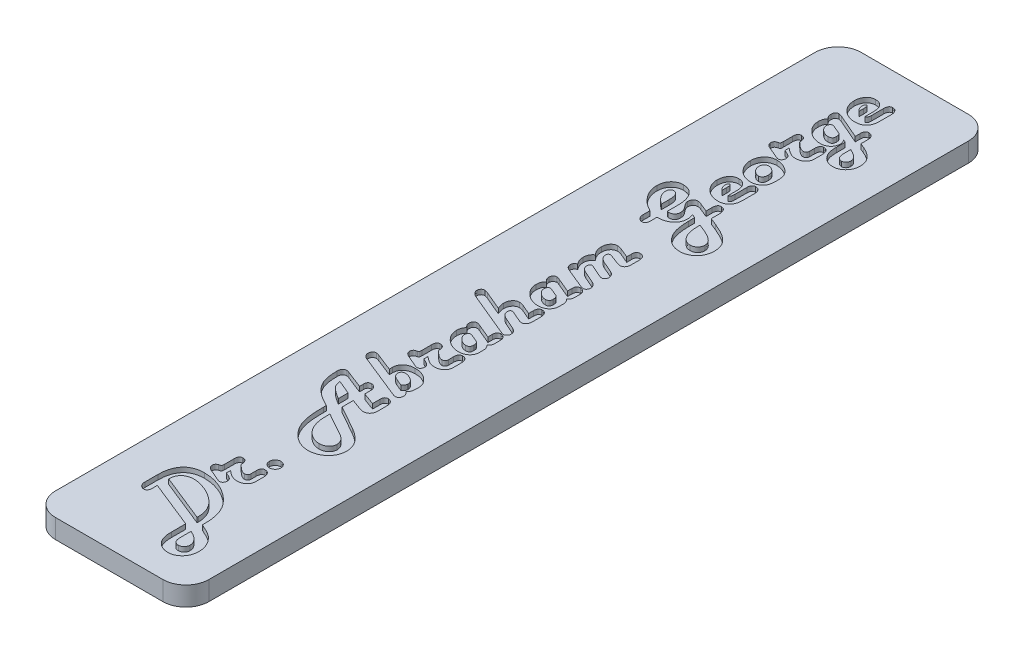
from build123d import *

# Parameters (mm, degrees)
BOSS_EXTRUDE1_DEPTH      = 66.675
BOSS_EXTRUDE1_DEPTH_BACK = 66.675
SKETCH3_W                = 25.4
SKETCH3_H                = 3.175
SKETCH5_OUTSIDE_W        = 54.556
SKETCH5_OUTSIDE_H        = 162.506
CUT_EXTRUDE2_DEPTH       = 68.947967225
CUT_EXTRUDE1_DEPTH       = 0.79375


with BuildPart() as part:
    # Sketch3 → Boss-Extrude1 (new, two sides: drawn at the far end of the back side and taken through both)
    with BuildSketch(Plane.XY.offset(-BOSS_EXTRUDE1_DEPTH_BACK)):
        Rectangle(SKETCH3_W, SKETCH3_H)
    extrude(amount=BOSS_EXTRUDE1_DEPTH + BOSS_EXTRUDE1_DEPTH_BACK)

    # Sketch5 outside → Cut-Extrude2 (cut, through all)
    with BuildSketch(Plane(origin=(0, 1.5875, 0), x_dir=(1, 0, 0), z_dir=(0, 1, 0))):
        Rectangle(SKETCH5_OUTSIDE_W, SKETCH5_OUTSIDE_H)
        with BuildLine():
            Line((12.7, -62.865), (12.7, 62.865))
            ThreePointArc((12.7, 62.865), (11.584076836, 65.559076836), (8.89, 66.675))
            Line((8.89, 66.675), (-8.89, 66.675))
            ThreePointArc((-8.89, 66.675), (-11.584076836, 65.559076836), (-12.7, 62.865))
            Line((-12.7, 62.865), (-12.7, -62.865))
            ThreePointArc((-12.7, -62.865), (-11.584076836, -65.559076836), (-8.89, -66.675))
            Line((-8.89, -66.675), (8.89, -66.675))
            ThreePointArc((8.89, -66.675), (11.584076836, -65.559076836), (12.7, -62.865))
        make_face(mode=Mode.SUBTRACT)
    extrude(amount=-CUT_EXTRUDE2_DEPTH, mode=Mode.SUBTRACT)

    # Sketch4 → Cut-Extrude1 (cut)
    # profile 1 of 16: a face of its own
    with BuildSketch(Plane(origin=(0, 1.5875, 0), x_dir=(1, 0, 0), z_dir=(0, 1, 0))):
        with BuildLine():
            Line((-5.059408711, -53.651033898), (-5.059408711, -54.312024135))
            Line((-5.059408711, -54.312024135), (-5.059408711, -54.492114289))
            add(Edge.make_bspline(
                [(-5.059408711, -54.492114289), (-5.061221798, -54.554234087), (-5.064618151, -54.670599624), (-5.091535017, -54.833526515), (-5.138308522, -54.97291669), (-5.205847499, -55.088132461), (-5.29318842, -55.17954695), (-5.402611201, -55.2416832), (-5.529823431, -55.280360571), (-5.621149297, -55.283864564), (-5.668944619, -55.285698376)],
                knots=[0, 0, 0, 0, 1.305737749, 2.445965353, 3.459324035, 4.379959175, 5.233349143, 6.085046436, 6.997810513, 8, 8, 8, 8], degree=3))
            add(Edge.make_bspline(
                [(-5.668944619, -55.285698376), (-5.731410963, -55.281985197), (-5.854689489, -55.274657169), (-6.031538734, -55.213145718), (-6.188487424, -55.107984943), (-6.326529965, -54.969526127), (-6.43823444, -54.801553868), (-6.52045023, -54.612043236), (-6.571281185, -54.404379523), (-6.576577835, -54.259543464), (-6.579290454, -54.185367323)],
                knots=[0, 0, 0, 0, 0.941902933, 1.858863449, 2.78744378, 3.773831386, 4.79357467, 5.815409039, 6.881186575, 8, 8, 8, 8], degree=3))
            Line((-6.579290454, -54.185367323), (-6.579290454, -54.005277169))
            Line((-6.579290454, -54.005277169), (-6.579290454, -52.048033623))
            add(Edge.make_bspline(
                [(-6.579290454, -52.048033623), (-6.576943694, -51.886970154), (-6.572385212, -51.574111145), (-6.528259255, -51.119667309), (-6.455923195, -50.694038238), (-6.353403231, -50.297353413), (-6.222361398, -49.929091601), (-6.065195062, -49.587861867), (-5.873740924, -49.278061331), (-5.655147073, -48.996955329), (-5.409385454, -48.746443216), (-5.136212127, -48.529153457), (-4.837107727, -48.345796442), (-4.511691276, -48.197441034), (-4.161606554, -48.080039114), (-3.786051006, -47.998196325), (-3.385240043, -47.947455728), (-3.109580017, -47.942272882), (-2.967592303, -47.939603288)],
                knots=[0, 0, 0, 0, 1.240121913, 2.408884614, 3.512215636, 4.562072732, 5.559962685, 6.519078054, 7.449661058, 8.358196616, 9.256317547, 10.145746268, 11.039719344, 11.951275398, 12.894325228, 13.877939151, 14.906963136, 16, 16, 16, 16], degree=3))
            add(Edge.make_bspline(
                [(-2.967592303, -47.939603288), (-2.747632965, -47.944649226), (-2.310664622, -47.954673421), (-1.662489052, -48.0438167), (-1.027874436, -48.183190346), (-0.407611195, -48.38084725), (0.198811118, -48.632731821), (0.789320154, -48.944229051), (1.369088674, -49.307632014), (1.733562556, -49.590810469), (1.918590017, -49.734567794)],
                knots=[0, 0, 0, 0, 0.99369571, 1.974062893, 2.951324249, 3.9272385, 4.912259598, 5.915104549, 6.941589699, 8, 8, 8, 8], degree=3))
            add(Edge.make_bspline(
                [(1.918590017, -49.734567794), (2.020560173, -49.819138355), (2.222042332, -49.98624077), (2.502478713, -50.254389543), (2.761785373, -50.529431674), (3.001726314, -50.811777963), (3.218070421, -51.104040501), (3.415328046, -51.403448241), (3.590018042, -51.711766682), (3.745118814, -52.02948264), (3.880396655, -52.359223082), (3.994887367, -52.704157601), (4.093794803, -53.064055836), (4.175487687, -53.440489387), (4.23491649, -53.832678616), (4.281986789, -54.23981296), (4.30655769, -54.663326015), (4.310957064, -54.951218819), (4.313195366, -55.097692171)],
                knots=[0, 0, 0, 0, 1.041972891, 2.058827374, 3.050103684, 4.014970579, 4.971989252, 5.909071109, 6.834104011, 7.757898592, 8.688895906, 9.635856426, 10.615406742, 11.624176682, 12.664286734, 13.734882699, 14.847559518, 16, 16, 16, 16], degree=3))
            Line((4.313195366, -55.097692171), (4.313195366, -55.56869719))
            Line((4.313195366, -55.56869719), (4.503180584, -55.64983671))
            add(Edge.make_bspline(
                [(4.503180584, -55.64983671), (4.588259484, -55.688135449), (4.751944871, -55.761819333), (4.988574197, -55.867598306), (5.203261613, -55.971409742), (5.399799285, -56.065804415), (5.57612167, -56.154596292), (5.731865259, -56.238205104), (5.86982203, -56.312353529), (6.025786476, -56.408233168), (6.206950257, -56.532270255), (6.417873247, -56.694449963), (6.623701124, -56.878894941), (6.754138311, -57.013865648), (6.820604438, -57.082641894)],
                knots=[0, 0, 0, 0, 1.222800361, 2.352575644, 3.396669397, 4.347862466, 5.210067408, 5.983579217, 6.664594993, 7.262130753, 8.381971782, 9.540587582, 10.746771362, 12, 12, 12, 12], degree=3))
            add(Edge.make_bspline(
                [(6.820604438, -57.082641894), (6.903395523, -57.176272065), (7.066380389, -57.360595062), (7.279287512, -57.656987669), (7.457034343, -57.96469338), (7.606030251, -58.280994344), (7.718433696, -58.609168634), (7.79973761, -58.947679013), (7.851106905, -59.29624271), (7.856747037, -59.532484063), (7.859586098, -59.65140036)],
                knots=[0, 0, 0, 0, 1.055914228, 2.078702545, 3.078046045, 4.055880218, 5.029205391, 6.004237832, 6.995397536, 8, 8, 8, 8], degree=3))
            add(Edge.make_bspline(
                [(7.859586098, -59.65140036), (7.856993501, -59.748441736), (7.851900251, -59.939083044), (7.821168372, -60.218186224), (7.764910307, -60.483588066), (7.687736712, -60.736064638), (7.588871721, -60.976227133), (7.467595534, -61.203010245), (7.324365245, -61.415840793), (7.160327756, -61.613151631), (6.979513426, -61.792262615), (6.785634375, -61.949471451), (6.578828947, -62.081374984), (6.361294215, -62.191395845), (6.129376676, -62.273584445), (5.887288606, -62.336104703), (5.632282094, -62.37180541), (5.458491616, -62.376227748), (5.36998814, -62.37847984)],
                knots=[0, 0, 0, 0, 1.126201464, 2.212463691, 3.25287726, 4.269850786, 5.272053028, 6.261782411, 7.249022054, 8.243830034, 9.23438794, 10.19795826, 11.134388982, 12.075812372, 13.02018767, 13.98375799, 14.973220915, 16, 16, 16, 16], degree=3))
            add(Edge.make_bspline(
                [(5.36998814, -62.37847984), (5.260123428, -62.375205005), (5.042463326, -62.368717016), (4.72333067, -62.30052816), (4.412900993, -62.20102894), (4.118355841, -62.055841686), (3.843725439, -61.877236481), (3.599045642, -61.666127125), (3.384255638, -61.426057946), (3.27040787, -61.244990341), (3.212864313, -61.153470988)],
                knots=[0, 0, 0, 0, 1.014242392, 2.009381349, 3.004557683, 4.021967388, 5.035219112, 6.025505851, 7.00200576, 8, 8, 8, 8], degree=3))
            add(Edge.make_bspline(
                [(3.212864313, -61.153470988), (3.178694237, -61.090057029), (3.108996627, -60.960709899), (3.024864607, -60.751463491), (2.954172904, -60.52689832), (2.894059757, -60.286524082), (2.850150029, -60.029686138), (2.815849805, -59.757058843), (2.796144893, -59.468306075), (2.794273346, -59.270140034), (2.793313624, -59.168521264)],
                knots=[0, 0, 0, 0, 0.84245226, 1.718372183, 2.633912599, 3.596293803, 4.615457363, 5.681185209, 6.810920853, 8, 8, 8, 8], degree=3))
            Line((2.793313624, -59.168521264), (2.793313624, -56.797664068))
            Line((2.793313624, -56.797664068), (-5.059408711, -53.651033898))
        make_face()
        with BuildLine():
            Line((2.793313624, -54.919581029), (2.793313624, -54.652414317))
            add(Edge.make_bspline(
                [(2.793313624, -54.652414317), (2.791702408, -54.566607127), (2.788512013, -54.396698866), (2.765744949, -54.144348151), (2.731199038, -53.896913397), (2.679029552, -53.655214067), (2.613727287, -53.419283971), (2.534611676, -53.188239187), (2.438580345, -52.962868223), (2.331215749, -52.740880407), (2.204488928, -52.526793055), (2.066703887, -52.316713165), (1.912916822, -52.112807803), (1.748048442, -51.911920347), (1.563156135, -51.720728017), (1.36913731, -51.529607699), (1.155852095, -51.348047819), (1.006709699, -51.232113466), (0.931062687, -51.173310016)],
                knots=[0, 0, 0, 0, 1.003752549, 1.98754731, 2.96218803, 3.924869515, 4.877913061, 5.824875223, 6.779479857, 7.742439712, 8.707376773, 9.687714611, 10.680189018, 11.694008127, 12.725763052, 13.790025714, 14.879071578, 16, 16, 16, 16], degree=3))
            add(Edge.make_bspline(
                [(0.931062687, -51.173310016), (0.78095443, -51.064037933), (0.481506127, -50.84605299), (0.004268718, -50.562671162), (-0.489791834, -50.311505814), (-0.997698155, -50.100683861), (-1.503867768, -49.92898922), (-1.997313923, -49.804887446), (-2.471672235, -49.727154102), (-2.782613813, -49.717498188), (-2.933949087, -49.712798654)],
                knots=[0, 0, 0, 0, 1.061151743, 2.116872814, 3.169496409, 4.227969904, 5.258553914, 6.222792805, 7.135033211, 8, 8, 8, 8], degree=3))
            add(Edge.make_bspline(
                [(-2.933949087, -49.712798654), (-3.013845359, -49.714086886), (-3.170118018, -49.716606594), (-3.398491181, -49.743087206), (-3.614094748, -49.785353414), (-3.815738777, -49.847939439), (-4.005154858, -49.924788476), (-4.182086066, -50.019752671), (-4.344678265, -50.133461085), (-4.494222588, -50.261952159), (-4.625964823, -50.407365556), (-4.744719615, -50.563446389), (-4.840786984, -50.734822056), (-4.920660454, -50.917156283), (-4.985190639, -51.111577516), (-5.026231366, -51.319771821), (-5.056449288, -51.539208697), (-5.058404564, -51.689718421), (-5.059408711, -51.767013822)],
                knots=[0, 0, 0, 0, 1.145531499, 2.240595844, 3.292755274, 4.292422607, 5.264114043, 6.220902991, 7.165828125, 8.104908158, 9.042461542, 9.975419986, 10.911970153, 11.852526766, 12.827988561, 13.843075609, 14.892295267, 16, 16, 16, 16], degree=3))
            Line((-5.059408711, -51.767013822), (2.793313624, -54.919581029))
        make_face(mode=Mode.SUBTRACT)
        with BuildLine():
            Line((4.313195366, -57.444801216), (4.313195366, -59.216017569))
            add(Edge.make_bspline(
                [(4.313195366, -59.216017569), (4.31614167, -59.315150853), (4.321654732, -59.500646943), (4.364073868, -59.760234311), (4.436805351, -59.981933799), (4.546252795, -60.162819825), (4.683522298, -60.307832692), (4.85579496, -60.408177387), (5.057259646, -60.468995234), (5.201313756, -60.475310649), (5.276974544, -60.478627662)],
                knots=[0, 0, 0, 0, 1.31364871, 2.458071474, 3.475829816, 4.38621616, 5.23967168, 6.094559773, 6.99921559, 8, 8, 8, 8], degree=3))
            add(Edge.make_bspline(
                [(5.276974544, -60.478627662), (5.340740764, -60.47547529), (5.46538183, -60.469313485), (5.642954311, -60.412786469), (5.806069188, -60.324698274), (5.945616014, -60.198712676), (6.065652646, -60.051881859), (6.151671976, -59.883284217), (6.2026179, -59.698518705), (6.209511273, -59.570583594), (6.213047544, -59.504953421)],
                knots=[0, 0, 0, 0, 1.015443884, 1.984844108, 2.946375274, 3.953924431, 4.965428653, 5.959234333, 6.953095811, 8, 8, 8, 8], degree=3))
            add(Edge.make_bspline(
                [(6.213047544, -59.504953421), (6.211514639, -59.4547314), (6.208451875, -59.354387174), (6.183926181, -59.205025821), (6.143090171, -59.057833032), (6.091088734, -58.910844319), (6.0182553, -58.767728514), (5.929850705, -58.627314084), (5.830080079, -58.485569529), (5.667591001, -58.302555068), (5.43470557, -58.080168894), (5.106825033, -57.841088098), (4.730688138, -57.62379582), (4.455753033, -57.505920964), (4.313195366, -57.444801216)],
                knots=[0, 0, 0, 0, 0.609246736, 1.21728261, 1.830931323, 2.461525313, 3.105941494, 3.774613737, 4.474427454, 5.206422339, 6.740961797, 8.372497183, 10.119089455, 12, 12, 12, 12], degree=3))
        make_face(mode=Mode.SUBTRACT)
    # profile 2 of 16: a face of its own
    with BuildSketch(Plane(origin=(0, 1.5875, 0), x_dir=(1, 0, 0), z_dir=(0, 1, 0))):
        with BuildLine():
            Line((-1.133047544, -46.148596808), (-0.590798068, -46.384099318))
            add(Edge.make_bspline(
                [(-0.590798068, -46.384099318), (-0.533457734, -46.410652246), (-0.424228786, -46.461233541), (-0.277391243, -46.551588481), (-0.150092315, -46.644045885), (-0.046402559, -46.745054188), (0.034874377, -46.852841094), (0.090963623, -46.967852514), (0.126477166, -47.088518585), (0.131161299, -47.171506691), (0.133520575, -47.213305633)],
                knots=[0, 0, 0, 0, 1.297501196, 2.471640463, 3.537215363, 4.524637192, 5.43567625, 6.296618738, 7.14205136, 8, 8, 8, 8], degree=3))
            add(Edge.make_bspline(
                [(0.133520575, -47.213305633), (0.132124839, -47.263019163), (0.129409557, -47.359732499), (0.093846564, -47.497215495), (0.040725262, -47.62375055), (-0.036730962, -47.732342412), (-0.126767084, -47.825072424), (-0.231464824, -47.892238302), (-0.348059997, -47.931108058), (-0.428897175, -47.936736152), (-0.470078294, -47.939603288)],
                knots=[0, 0, 0, 0, 1.131994738, 2.202197021, 3.220602635, 4.248319073, 5.22801886, 6.155513921, 7.060358075, 8, 8, 8, 8], degree=3))
            add(Edge.make_bspline(
                [(-0.470078294, -47.939603288), (-0.499218044, -47.937021926), (-0.566980404, -47.931019155), (-0.679647346, -47.900874438), (-0.816933777, -47.851759586), (-0.916176579, -47.811399681), (-0.970768504, -47.789198324)],
                knots=[0, 0, 0, 0, 0.667539348, 1.552314029, 2.65356594, 4, 4, 4, 4], degree=3))
            Line((-0.970768504, -47.789198324), (-2.763753997, -47.01936239))
            add(Edge.make_bspline(
                [(-2.763753997, -47.01936239), (-2.815170125, -46.996144538), (-2.913349865, -46.951809762), (-3.045413745, -46.868925877), (-3.158743629, -46.781139745), (-3.251729515, -46.684741562), (-3.324450011, -46.581613032), (-3.374003716, -46.469759409), (-3.408159145, -46.351808283), (-3.41128251, -46.269563439), (-3.412870157, -46.227757315)],
                knots=[0, 0, 0, 0, 1.242093141, 2.371792344, 3.427691145, 4.394328043, 5.313892613, 6.192305435, 7.081125362, 8, 8, 8, 8], degree=3))
            add(Edge.make_bspline(
                [(-3.412870157, -46.227757315), (-3.411163979, -46.187441281), (-3.407925024, -46.110906623), (-3.388612461, -46.001137936), (-3.353327552, -45.903825213), (-3.302774108, -45.818738499), (-3.238231802, -45.745345247), (-3.157775444, -45.686805081), (-3.064804408, -45.637311629), (-2.995783937, -45.616982438), (-2.959676252, -45.606347332)],
                knots=[0, 0, 0, 0, 1.15314347, 2.189090296, 3.173792814, 4.095790583, 5.004376053, 5.947550008, 6.926271946, 8, 8, 8, 8], degree=3))
            Line((-2.959676252, -45.606347332), (-2.759795971, -45.550934977))
            add(Edge.make_bspline(
                [(-2.759795971, -45.550934977), (-2.735748973, -45.544523142), (-2.691703864, -45.532779057), (-2.634585283, -45.504602003), (-2.59151934, -45.471598258), (-2.560947532, -45.42706982), (-2.544747313, -45.364479112), (-2.534309592, -45.277532642), (-2.526479032, -45.161844359), (-2.526345982, -45.074663098), (-2.526272474, -45.026496615)],
                knots=[0, 0, 0, 0, 0.926850573, 1.697643703, 2.362895762, 2.92973869, 3.677374781, 4.746381598, 6.202419277, 8, 8, 8, 8], degree=3))
            Line((-2.526272474, -45.026496615), (-2.526272474, -43.463076594))
            add(Edge.make_bspline(
                [(-2.526272474, -43.463076594), (-2.524532467, -43.396992634), (-2.521278246, -43.273400184), (-2.493558114, -43.100395745), (-2.449642601, -42.952842912), (-2.386772452, -42.829661617), (-2.300876341, -42.735335469), (-2.196591421, -42.668077489), (-2.07396949, -42.627311488), (-1.986325506, -42.622522168), (-1.940484719, -42.62001719)],
                knots=[0, 0, 0, 0, 1.361355543, 2.546053047, 3.599677592, 4.524244374, 5.371169927, 6.197098625, 7.057021238, 8, 8, 8, 8], degree=3))
            add(Edge.make_bspline(
                [(-1.940484719, -42.62001719), (-1.876704344, -42.622263069), (-1.755337885, -42.626536708), (-1.587019418, -42.680309196), (-1.441985775, -42.7644372), (-1.327816684, -42.888674864), (-1.236574655, -43.043368555), (-1.175701967, -43.232415226), (-1.138009761, -43.453651493), (-1.134775851, -43.611982736), (-1.133047544, -43.696600091)],
                knots=[0, 0, 0, 0, 0.994284648, 1.892005291, 2.734571892, 3.588753721, 4.500369607, 5.525254763, 6.677415825, 8, 8, 8, 8], degree=3))
            Line((-1.133047544, -43.696600091), (-1.067740125, -43.765865535))
            add(Edge.make_bspline(
                [(-1.067740125, -43.765865535), (-0.987921256, -43.845051824), (-0.835136029, -43.996626197), (-0.60704457, -44.201900478), (-0.391993659, -44.375162569), (-0.193594409, -44.519537471), (-0.006185567, -44.629486404), (0.165468107, -44.709742942), (0.324390219, -44.762590127), (0.42739902, -44.769792514), (0.475889769, -44.773182992)],
                knots=[0, 0, 0, 0, 1.435762249, 2.748263184, 3.91660617, 4.961556361, 5.879059361, 6.685751502, 7.381325737, 8, 8, 8, 8], degree=3))
            add(Edge.make_bspline(
                [(0.475889769, -44.773182992), (0.518360985, -44.772343629), (0.59906364, -44.770748695), (0.710559399, -44.740597319), (0.809251217, -44.701936312), (0.88615109, -44.636841804), (0.948196196, -44.557147834), (0.990380475, -44.459101012), (1.017109736, -44.344489284), (1.019069792, -44.262771563), (1.020118258, -44.21905944)],
                knots=[0, 0, 0, 0, 1.140484469, 2.167117703, 3.098941929, 3.971150526, 4.846255631, 5.80154673, 6.824011975, 8, 8, 8, 8], degree=3))
            Line((1.020118258, -44.21905944), (1.020118258, -43.376000036))
            add(Edge.make_bspline(
                [(1.020118258, -43.376000036), (1.021984217, -43.306658663), (1.025466972, -43.177235112), (1.051533923, -42.995529677), (1.100887158, -42.841875533), (1.167116652, -42.713815818), (1.255478016, -42.614227605), (1.363636668, -42.542824595), (1.492717348, -42.500133319), (1.585120442, -42.49569142), (1.63361219, -42.493360378)],
                knots=[0, 0, 0, 0, 1.364190584, 2.546219988, 3.596843527, 4.525897283, 5.362221888, 6.186477391, 7.048290713, 8, 8, 8, 8], degree=3))
            add(Edge.make_bspline(
                [(1.63361219, -42.493360378), (1.70200856, -42.496942937), (1.833530254, -42.50383196), (2.018290659, -42.562716493), (2.178749377, -42.660476272), (2.309797916, -42.799063462), (2.41659376, -42.969406979), (2.487295379, -43.173769852), (2.534438198, -43.405507049), (2.538083095, -43.57033458), (2.54, -43.657019837)],
                knots=[0, 0, 0, 0, 0.982615473, 1.889504555, 2.759142238, 3.658944971, 4.610088785, 5.631441668, 6.75433984, 8, 8, 8, 8], degree=3))
            Line((2.54, -43.657019837), (2.54, -44.967126235))
            add(Edge.make_bspline(
                [(2.54, -44.967126235), (2.538430408, -45.019326345), (2.535356682, -45.121549619), (2.512617758, -45.271283805), (2.478022786, -45.41442014), (2.425832595, -45.549588586), (2.359635976, -45.677293145), (2.280705326, -45.799070963), (2.184687895, -45.911703257), (2.076052454, -46.016566191), (1.955607585, -46.110694238), (1.827028716, -46.194629465), (1.68869591, -46.264095753), (1.5424848, -46.321746601), (1.386467302, -46.365092906), (1.222288609, -46.396174324), (1.049676112, -46.417036355), (0.931785098, -46.418814943), (0.871692306, -46.419721546)],
                knots=[0, 0, 0, 0, 1.009407673, 1.976719137, 2.923785669, 3.852797958, 4.771676065, 5.702527031, 6.65345443, 7.628144937, 8.618662201, 9.606215811, 10.593522047, 11.607757909, 12.641947342, 13.720607507, 14.838121302, 16, 16, 16, 16], degree=3))
            add(Edge.make_bspline(
                [(0.871692306, -46.419721546), (0.793683688, -46.416914797), (0.637343317, -46.411289672), (0.405084974, -46.369982037), (0.175746401, -46.304982495), (-0.053629714, -46.208578494), (-0.292447526, -46.07701468), (-0.551427767, -45.907118161), (-0.835914279, -45.696552055), (-1.030170108, -45.537955645), (-1.133047544, -45.453963355)],
                knots=[0, 0, 0, 0, 0.822710096, 1.64882809, 2.481516469, 3.333299355, 4.267584386, 5.354441073, 6.598918144, 8, 8, 8, 8], degree=3))
            Line((-1.133047544, -45.453963355), (-1.133047544, -46.148596808))
        make_face()
    # profile 3 of 16: a face of its own
    with BuildSketch(Plane(origin=(0, 1.5875, 0), x_dir=(1, 0, 0), z_dir=(0, 1, 0))):
        with BuildLine():
            add(Edge.make_bspline(
                [(0.766804634, -40.906192205), (0.770139014, -40.843136202), (0.776646221, -40.720079275), (0.830830714, -40.542726355), (0.91939683, -40.379602535), (1.042292932, -40.235712439), (1.186183028, -40.112816337), (1.349306847, -40.024250221), (1.526659768, -39.970065728), (1.649716695, -39.963558521), (1.712772698, -39.960224141)],
                knots=[0, 0, 0, 0, 1.018015329, 1.986707578, 2.970091954, 4, 5.029908046, 6.013292422, 6.981984671, 8, 8, 8, 8], degree=3))
            add(Edge.make_bspline(
                [(1.712772698, -39.960224141), (1.776467102, -39.963633019), (1.901411116, -39.970319932), (2.081524984, -40.023840606), (2.246960005, -40.112239849), (2.391134327, -40.23576623), (2.514073317, -40.379588844), (2.602628499, -40.542729868), (2.656815813, -40.72007835), (2.663322631, -40.843135889), (2.666656812, -40.906192205)],
                knots=[0, 0, 0, 0, 1.023458974, 2.007634331, 2.995409192, 4.02013336, 5.044857529, 6.023292197, 6.987108688, 8, 8, 8, 8], degree=3))
            add(Edge.make_bspline(
                [(2.666656812, -40.906192205), (2.663248136, -40.969886927), (2.656561621, -41.094831567), (2.603038054, -41.274940882), (2.514649886, -41.440393336), (2.391080568, -41.584500075), (2.246973829, -41.708069394), (2.081521375, -41.796457561), (1.901412059, -41.849981128), (1.77646742, -41.856667643), (1.712772698, -41.860076319)],
                knots=[0, 0, 0, 0, 1.018333356, 1.997579833, 2.980407786, 4, 5.019592214, 6.002420167, 6.981666644, 8, 8, 8, 8], degree=3))
            add(Edge.make_bspline(
                [(1.712772698, -41.860076319), (1.649716382, -41.856742139), (1.526658843, -41.85023532), (1.349310361, -41.796048006), (1.186169337, -41.707492825), (1.042346723, -41.584553834), (0.918820342, -41.440379513), (0.830421099, -41.274944491), (0.776900424, -41.094830624), (0.770213512, -40.969886609), (0.766804634, -40.906192205)],
                knots=[0, 0, 0, 0, 1.012891312, 1.976707803, 2.955142471, 3.97986664, 5.004590808, 5.992365669, 6.976541026, 8, 8, 8, 8], degree=3))
        make_face()
    # profile 4 of 16: a face of its own
    with BuildSketch(Plane(origin=(0, 1.5875, 0), x_dir=(1, 0, 0), z_dir=(0, 1, 0))):
        with BuildLine():
            Line((-1.006390732, -25.260117915), (-1.006390732, -27.110494776))
            Line((-1.006390732, -27.110494776), (2.917991423, -29.328967996))
            add(Edge.make_bspline(
                [(2.917991423, -29.328967996), (3.031501235, -29.393773678), (3.253566114, -29.520556251), (3.568159032, -29.726578592), (3.863424899, -29.9325193), (4.135192102, -30.145810943), (4.387594203, -30.360803248), (4.617333827, -30.581889609), (4.823424221, -30.809130529), (5.011452679, -31.037620234), (5.172879928, -31.274867269), (5.317150301, -31.513393392), (5.43565356, -31.759198622), (5.536076547, -32.007788777), (5.610148105, -32.262804386), (5.667153447, -32.52033636), (5.698611435, -32.783548268), (5.703803354, -32.96038086), (5.706420296, -33.049511844)],
                knots=[0, 0, 0, 0, 1.284127512, 2.512202389, 3.693820525, 4.820683154, 5.905595552, 6.95085666, 7.951169987, 8.919030195, 9.855848477, 10.768583501, 11.655730142, 12.534476643, 13.400021201, 14.262063092, 15.124007484, 16, 16, 16, 16], degree=3))
            add(Edge.make_bspline(
                [(5.706420296, -33.049511844), (5.703180194, -33.157841411), (5.696831243, -33.370112232), (5.652585795, -33.682659661), (5.577881997, -33.981292451), (5.471548858, -34.266901455), (5.337480262, -34.539012854), (5.170021829, -34.796184771), (4.976940055, -35.042274676), (4.753019039, -35.269837747), (4.509624702, -35.479038032), (4.248076931, -35.662124592), (3.970921127, -35.813731804), (3.682284108, -35.943730591), (3.376580606, -36.038132811), (3.058709308, -36.111029596), (2.725821084, -36.152785333), (2.499213327, -36.157907706), (2.383657998, -36.160519785)],
                knots=[0, 0, 0, 0, 1.023509052, 2.005556865, 2.976162568, 3.926806602, 4.88020563, 5.83639235, 6.821600422, 7.8310613, 8.847943164, 9.850897116, 10.841415261, 11.829399931, 12.83678008, 13.859073563, 14.908265711, 16, 16, 16, 16], degree=3))
            add(Edge.make_bspline(
                [(2.383657998, -36.160519785), (2.288550738, -36.158987535), (2.098388915, -36.155923882), (1.814882908, -36.119514303), (1.533429132, -36.067468252), (1.254598054, -35.990726878), (0.978283761, -35.894870795), (0.705289721, -35.773969241), (0.434393506, -35.634158994), (0.168525477, -35.471912448), (-0.090225841, -35.291807586), (-0.340594155, -35.096293152), (-0.577175013, -34.881920585), (-0.803834952, -34.653400244), (-1.019799612, -34.410046588), (-1.223700251, -34.150157816), (-1.41641437, -33.874470592), (-1.53446039, -33.681455185), (-1.5941575, -33.583845269)],
                knots=[0, 0, 0, 0, 0.920360802, 1.840211654, 2.763493683, 3.690106123, 4.637553702, 5.592892168, 6.578521632, 7.587450506, 8.606298991, 9.629842057, 10.661069622, 11.695398393, 12.745173504, 13.809615302, 14.892299487, 16, 16, 16, 16], degree=3))
            add(Edge.make_bspline(
                [(-1.5941575, -33.583845269), (-1.67605063, -33.432138058), (-1.840739981, -33.127050659), (-2.03951315, -32.641506252), (-2.199344014, -32.132638406), (-2.303533171, -31.689774356), (-2.369166346, -31.315467862), (-2.408957339, -31.009497309), (-2.448608275, -30.681946665), (-2.473466587, -30.331134551), (-2.499063233, -29.958567383), (-2.513416775, -29.563236927), (-2.523788558, -29.145634925), (-2.525430662, -28.85994945), (-2.526272474, -28.713495051)],
                knots=[0, 0, 0, 0, 1.235982978, 2.485595966, 3.756177378, 5.05891948, 5.745857238, 6.481327979, 7.271967052, 8.112145328, 9.003570026, 9.950725021, 10.949455392, 12, 12, 12, 12], degree=3))
            Line((-2.526272474, -28.713495051), (-2.526272474, -28.218741879))
            Line((-2.526272474, -28.218741879), (-3.484114614, -27.694303518))
            add(Edge.make_bspline(
                [(-3.484114614, -27.694303518), (-3.645129376, -27.602865766), (-3.959418911, -27.424385681), (-4.39661466, -27.125631453), (-4.795949378, -26.815745802), (-5.149361581, -26.486060412), (-5.466624467, -26.14585035), (-5.734837692, -25.784866626), (-5.969402651, -25.412872761), (-6.089981143, -25.149456526), (-6.149844701, -25.018678367)],
                knots=[0, 0, 0, 0, 1.154231185, 2.252978409, 3.298924017, 4.303170672, 5.263936639, 6.195269199, 7.104005978, 8, 8, 8, 8], degree=3))
            add(Edge.make_bspline(
                [(-6.149844701, -25.018678367), (-6.184740577, -24.931394275), (-6.25628963, -24.752430601), (-6.342088, -24.468235715), (-6.414534009, -24.164700199), (-6.476665425, -23.842698778), (-6.520868337, -23.500201002), (-6.55386069, -23.139108185), (-6.577204404, -22.758288333), (-6.578583785, -22.498112605), (-6.579290454, -22.364822356)],
                knots=[0, 0, 0, 0, 0.833580457, 1.709138717, 2.630308376, 3.601286859, 4.616795241, 5.692327562, 6.817759698, 8, 8, 8, 8], degree=3))
            add(Edge.make_bspline(
                [(-6.579290454, -22.364822356), (-6.577043826, -22.298715855), (-6.572765204, -22.172818406), (-6.539988946, -21.994797301), (-6.482386271, -21.838934288), (-6.401139526, -21.706090914), (-6.297415903, -21.600145441), (-6.175074513, -21.520976543), (-6.031915177, -21.477555075), (-5.931110858, -21.471484607), (-5.878719963, -21.46832961)],
                knots=[0, 0, 0, 0, 1.235229773, 2.35245055, 3.366973227, 4.325000809, 5.240507286, 6.116206508, 7.020938506, 8, 8, 8, 8], degree=3))
            add(Edge.make_bspline(
                [(-5.878719963, -21.46832961), (-5.823534246, -21.472845804), (-5.701517046, -21.482831238), (-5.585850675, -21.523329386), (-5.52249768, -21.545511105)],
                knots=[0, 0, 0, 0, 0.904556353, 2, 2, 2, 2], degree=3))
            Line((-5.52249768, -21.545511105), (-5.372092716, -21.604881485))
            Line((-5.372092716, -21.604881485), (-2.526272474, -22.715107602))
            Line((-2.526272474, -22.715107602), (-2.526272474, -22.208480354))
            Line((-2.526272474, -22.208480354), (-2.526272474, -22.034327238))
            add(Edge.make_bspline(
                [(-2.526272474, -22.034327238), (-2.524680335, -21.980067474), (-2.521681818, -21.877878683), (-2.491692514, -21.73552396), (-2.444514275, -21.613273695), (-2.377037473, -21.511446264), (-2.286327445, -21.433427037), (-2.17625873, -21.380656918), (-2.048859795, -21.345172929), (-1.957246984, -21.342883166), (-1.908820517, -21.341672798)],
                knots=[0, 0, 0, 0, 1.224457869, 2.306052593, 3.269225765, 4.170438305, 5.03696607, 5.936821825, 6.909405468, 8, 8, 8, 8], degree=3))
            add(Edge.make_bspline(
                [(-1.908820517, -21.341672798), (-1.84831325, -21.344740327), (-1.729217739, -21.350778098), (-1.5590833, -21.409795111), (-1.403467723, -21.502789678), (-1.266958503, -21.630285716), (-1.149449282, -21.780614874), (-1.066252598, -21.953477551), (-1.014069897, -22.14212733), (-1.009001589, -22.273433794), (-1.006390732, -22.341074204)],
                knots=[0, 0, 0, 0, 0.967844388, 1.904993043, 2.854314898, 3.858179587, 4.884883616, 5.897857367, 6.917115065, 8, 8, 8, 8], degree=3))
            Line((-1.006390732, -22.341074204), (-1.006390732, -22.521164358))
            Line((-1.006390732, -22.521164358), (-1.006390732, -23.364223762))
            Line((-1.006390732, -23.364223762), (1.020118258, -24.104374507))
            Line((1.020118258, -24.104374507), (1.020118258, -23.01591753))
            Line((1.020118258, -23.01591753), (1.020118258, -22.841764413))
            add(Edge.make_bspline(
                [(1.020118258, -22.841764413), (1.021963451, -22.783608219), (1.025426424, -22.674463397), (1.052019981, -22.521790056), (1.099576614, -22.391896233), (1.166471274, -22.284268216), (1.256179198, -22.202127518), (1.362966764, -22.140737445), (1.491292162, -22.108252008), (1.58199516, -22.103900255), (1.629654165, -22.101613669)],
                knots=[0, 0, 0, 0, 1.273098158, 2.389290989, 3.376549181, 4.286045457, 5.134299476, 6.013945099, 6.956446832, 8, 8, 8, 8], degree=3))
            add(Edge.make_bspline(
                [(1.629654165, -22.101613669), (1.691513114, -22.105299433), (1.812767411, -22.112524171), (1.985783455, -22.173672843), (2.144110119, -22.270338849), (2.279484814, -22.406697372), (2.397203033, -22.564577161), (2.480587582, -22.74590501), (2.532060556, -22.94315587), (2.537309968, -23.080241584), (2.54, -23.150490392)],
                knots=[0, 0, 0, 0, 0.959970407, 1.881708946, 2.821665646, 3.823251842, 4.851715016, 5.871022397, 6.909017313, 8, 8, 8, 8], degree=3))
            Line((2.54, -23.150490392), (2.54, -23.330580547))
            Line((2.54, -23.330580547), (2.54, -24.759427706))
            add(Edge.make_bspline(
                [(2.54, -24.759427706), (2.53633904, -24.848801343), (2.529286764, -25.020965911), (2.471342729, -25.266867802), (2.373037177, -25.486378612), (2.238603295, -25.677401465), (2.07218228, -25.832905981), (1.879338522, -25.946800013), (1.662748929, -26.017023876), (1.510127035, -26.024259309), (1.431752896, -26.027974837)],
                knots=[0, 0, 0, 0, 1.135640793, 2.187637353, 3.190204587, 4.177136149, 5.13878535, 6.063917208, 7.005786023, 8, 8, 8, 8], degree=3))
            add(Edge.make_bspline(
                [(1.431752896, -26.027974837), (1.361624694, -26.024399017), (1.206105366, -26.016469124), (0.955289396, -25.962146108), (0.665075711, -25.877716323), (0.460979335, -25.804268141), (0.35121197, -25.76476615)],
                knots=[0, 0, 0, 0, 0.753316793, 1.670587834, 2.747192678, 4, 4, 4, 4], degree=3))
            Line((0.35121197, -25.76476615), (-1.006390732, -25.260117915))
        make_face()
        with BuildLine():
            Line((-2.526272474, -24.605064716), (-4.82984324, -23.643264551))
            add(Edge.make_bspline(
                [(-4.82984324, -23.643264551), (-4.818964788, -23.757343879), (-4.797779906, -23.979503891), (-4.706080819, -24.295003256), (-4.5741856, -24.582981294), (-4.427386599, -24.80208694), (-4.280501183, -24.964564002), (-4.15280666, -25.093308394), (-4.002372773, -25.223409876), (-3.834632214, -25.36009923), (-3.646227244, -25.500400817), (-3.43749854, -25.6443275), (-3.211079805, -25.795409525), (-3.050441878, -25.892699596), (-2.967592303, -25.942877291)],
                knots=[0, 0, 0, 0, 1.327479438, 2.585155888, 3.790872231, 4.992669277, 5.627155637, 6.330882107, 7.09570796, 7.933840435, 8.841788147, 9.820799051, 10.876069462, 12, 12, 12, 12], degree=3))
            Line((-2.967592303, -25.942877291), (-2.526272474, -26.215981042))
            Line((-2.526272474, -26.215981042), (-2.526272474, -24.605064716))
        make_face(mode=Mode.SUBTRACT)
        with BuildLine():
            Line((-1.006390732, -29.135024753), (-1.006390732, -29.701022381))
            add(Edge.make_bspline(
                [(-1.006390732, -29.701022381), (-1.004050882, -29.854787696), (-0.999485869, -30.154781469), (-0.965750548, -30.592940919), (-0.909504546, -31.006945208), (-0.827771911, -31.396158733), (-0.726338021, -31.761397825), (-0.598890288, -32.101509628), (-0.449712213, -32.418209447), (-0.329410469, -32.613164759), (-0.270198013, -32.709121662)],
                knots=[0, 0, 0, 0, 1.17507216, 2.292547767, 3.356328211, 4.36586142, 5.329840842, 6.250349605, 7.138822986, 8, 8, 8, 8], degree=3))
            add(Edge.make_bspline(
                [(-0.270198013, -32.709121662), (-0.189749502, -32.823392019), (-0.030218786, -33.04999201), (0.254432745, -33.350269738), (0.56451857, -33.6182772), (0.900643857, -33.845849117), (1.252534103, -34.030934122), (1.612871207, -34.161376983), (1.974692893, -34.246173564), (2.217630653, -34.255861751), (2.338140706, -34.260667608)],
                knots=[0, 0, 0, 0, 1.061931571, 2.105827722, 3.137883091, 4.174868311, 5.187188109, 6.15404082, 7.084306037, 8, 8, 8, 8], degree=3))
            add(Edge.make_bspline(
                [(2.338140706, -34.260667608), (2.444130717, -34.255769624), (2.651648724, -34.246179855), (2.950882983, -34.16948294), (3.224724944, -34.040211514), (3.429522346, -33.892946554), (3.574674876, -33.755545402), (3.671410475, -33.646411922), (3.750545533, -33.529751167), (3.818463763, -33.409973131), (3.870833269, -33.283814155), (3.905909924, -33.151955678), (3.928360466, -33.01531061), (3.931593953, -32.922282374), (3.93322493, -32.875358728)],
                knots=[0, 0, 0, 0, 1.625345399, 3.182266278, 4.704124598, 6.249545861, 7.030225429, 7.76935358, 8.482720177, 9.189807842, 9.879872433, 10.572531956, 11.279981989, 12, 12, 12, 12], degree=3))
            add(Edge.make_bspline(
                [(3.93322493, -32.875358728), (3.929066917, -32.792470826), (3.920753002, -32.626737147), (3.85184544, -32.383403127), (3.740272663, -32.149472099), (3.588138012, -31.921135262), (3.389054614, -31.704075954), (3.148573098, -31.493037433), (2.865100925, -31.289618565), (2.655241037, -31.167662372), (2.545937038, -31.104142375)],
                knots=[0, 0, 0, 0, 0.841394824, 1.682362055, 2.549233927, 3.467926034, 4.460234473, 5.5338279, 6.715512172, 8, 8, 8, 8], degree=3))
            Line((2.545937038, -31.104142375), (-1.006390732, -29.135024753))
        make_face(mode=Mode.SUBTRACT)
    # profile 5 of 16: a face of its own
    with BuildSketch(Plane(origin=(0, 1.5875, 0), x_dir=(1, 0, 0), z_dir=(0, 1, 0))):
        with BuildLine():
            add(Edge.make_bspline(
                [(-2.526272474, -17.781428977), (-2.526272474, -17.687096039), (-2.526272474, -17.509644568), (-2.526272474, -17.332193098), (-2.526272474, -17.249074565)],
                knots=[0, 0, 0, 0, 1.063197026, 2, 2, 2, 2], degree=3))
            add(Edge.make_bspline(
                [(-2.526272474, -17.249074565), (-2.525170421, -17.186283425), (-2.523001241, -17.062691214), (-2.493472356, -16.882575467), (-2.450596168, -16.710497892), (-2.389073662, -16.54767253), (-2.309529181, -16.394105203), (-2.211602683, -16.251399584), (-2.097563195, -16.116678291), (-1.965283283, -15.993644876), (-1.819925404, -15.880968022), (-1.662133886, -15.784075317), (-1.49525974, -15.69955701), (-1.316219222, -15.633383302), (-1.127882147, -15.579225856), (-0.929109828, -15.542038301), (-0.719925129, -15.520221694), (-0.57699831, -15.517073495), (-0.50372151, -15.515459453)],
                knots=[0, 0, 0, 0, 1.006798103, 1.981687273, 2.921621063, 3.849852109, 4.76861364, 5.690785672, 6.622212015, 7.596008033, 8.585054901, 9.569386178, 10.563802963, 11.58250184, 12.628246196, 13.706038284, 14.823914389, 16, 16, 16, 16], degree=3))
            add(Edge.make_bspline(
                [(-0.50372151, -15.515459453), (-0.362994468, -15.519685017), (-0.087975207, -15.527942929), (0.313258463, -15.591225557), (0.689023298, -15.701831258), (1.043879682, -15.849424569), (1.371843301, -16.046249263), (1.677105801, -16.283085088), (1.957279988, -16.56504388), (2.118936929, -16.779332731), (2.201588831, -16.888894256)],
                knots=[0, 0, 0, 0, 1.067622645, 2.086427644, 3.071738449, 4.033994246, 4.994621208, 5.964863958, 6.959476384, 8, 8, 8, 8], degree=3))
            add(Edge.make_bspline(
                [(2.201588831, -16.888894256), (2.253767053, -16.967890133), (2.355413557, -17.121779139), (2.459806628, -17.373332149), (2.52697296, -17.628833864), (2.535673954, -17.802133069), (2.54, -17.888295662)],
                knots=[0, 0, 0, 0, 1.058097439, 2.061241283, 3.03606898, 4, 4, 4, 4], degree=3))
            Line((2.54, -17.888295662), (2.54, -18.521579722))
            add(Edge.make_bspline(
                [(2.54, -18.521579722), (2.538394529, -18.575750943), (2.535229256, -18.682552423), (2.512674545, -18.839537011), (2.477682742, -18.991044107), (2.425717357, -19.136351093), (2.358460999, -19.274939761), (2.275518157, -19.4065051), (2.181291742, -19.534574577), (2.10685503, -19.612143042), (2.068994981, -19.651595965)],
                knots=[0, 0, 0, 0, 1.033031102, 2.036676463, 3.019438489, 3.994517829, 4.973729052, 5.951402988, 6.958041255, 8, 8, 8, 8], degree=3))
            add(Edge.make_bspline(
                [(2.068994981, -19.651595965), (2.106696367, -19.675624864), (2.180298671, -19.722535137), (2.276229758, -19.809408173), (2.357405375, -19.904895661), (2.427379184, -20.00928811), (2.47759391, -20.12633987), (2.51323059, -20.252834128), (2.535386122, -20.388339333), (2.538431828, -20.482035417), (2.54, -20.530277597)],
                knots=[0, 0, 0, 0, 1.022746321, 1.996650328, 2.95065247, 3.889573009, 4.863945916, 5.854129293, 6.895135444, 8, 8, 8, 8], degree=3))
            add(Edge.make_bspline(
                [(2.54, -20.530277597), (2.537901874, -20.576073758), (2.533789755, -20.665829683), (2.495873186, -20.794285344), (2.438953879, -20.914095548), (2.354988315, -21.017198743), (2.257433839, -21.103797386), (2.148223526, -21.169992776), (2.026715428, -21.208953778), (1.941954029, -21.212970813), (1.89879989, -21.215015986)],
                knots=[0, 0, 0, 0, 1.052000038, 2.061815534, 3.060373493, 4.08751788, 5.099159445, 6.052567918, 7.008513824, 8, 8, 8, 8], degree=3))
            add(Edge.make_bspline(
                [(1.89879989, -21.215015986), (1.864372707, -21.214083474), (1.791575547, -21.212111652), (1.680342108, -21.187076325), (1.559498082, -21.157294429), (1.479570228, -21.125046466), (1.437689934, -21.108149301)],
                knots=[0, 0, 0, 0, 0.865990083, 1.83115821, 2.863578508, 4, 4, 4, 4], degree=3))
            Line((1.437689934, -21.108149301), (1.25759978, -21.036904845))
            Line((1.25759978, -21.036904845), (-5.643217454, -18.26232906))
            Line((-5.643217454, -18.26232906), (-5.831223659, -18.191084603))
            add(Edge.make_bspline(
                [(-5.831223659, -18.191084603), (-5.890790833, -18.164996754), (-6.004766019, -18.115080547), (-6.155560156, -18.01746658), (-6.28729157, -17.91564324), (-6.393449258, -17.798685531), (-6.477825131, -17.672408099), (-6.535768539, -17.533867268), (-6.572961527, -17.386263131), (-6.577153208, -17.283606042), (-6.579290454, -17.231263451)],
                knots=[0, 0, 0, 0, 1.200202782, 2.296455031, 3.311628121, 4.269821036, 5.203405519, 6.104976448, 7.033769191, 8, 8, 8, 8], degree=3))
            add(Edge.make_bspline(
                [(-6.579290454, -17.231263451), (-6.577138088, -17.183523911), (-6.572918969, -17.089943705), (-6.536105762, -16.956453217), (-6.478028754, -16.834341411), (-6.396391862, -16.728167893), (-6.298966833, -16.639259388), (-6.18782692, -16.574314127), (-6.066067088, -16.534672011), (-5.981265132, -16.530723985), (-5.938090344, -16.528713947)],
                knots=[0, 0, 0, 0, 1.0800039, 2.117049857, 3.113212976, 4.126721309, 5.132261338, 6.083444077, 7.024233645, 8, 8, 8, 8], degree=3))
            add(Edge.make_bspline(
                [(-5.938090344, -16.528713947), (-5.863526588, -16.534098579), (-5.703000429, -16.545690997), (-5.551937927, -16.601654126), (-5.47104335, -16.631622607)],
                knots=[0, 0, 0, 0, 0.928991957, 2, 2, 2, 2], degree=3))
            Line((-5.47104335, -16.631622607), (-5.283037145, -16.704846076))
            Line((-5.283037145, -16.704846076), (-2.526272474, -17.781428977))
        make_face()
        with BuildLine():
            add(Edge.make_bspline(
                [(0.71930833, -19.109346489), (0.784934184, -19.054734581), (0.909783173, -18.950838922), (1.043775141, -18.757128927), (1.133655697, -18.551506878), (1.142391724, -18.406387759), (1.14677507, -18.333573516)],
                knots=[0, 0, 0, 0, 1.110869678, 2.113358473, 3.053368192, 4, 4, 4, 4], degree=3))
            add(Edge.make_bspline(
                [(1.14677507, -18.333573516), (1.144265383, -18.282626636), (1.139390707, -18.183670235), (1.108220106, -18.041157942), (1.051722228, -17.911003234), (0.997780365, -17.835330841), (0.970642941, -17.797261079)],
                knots=[0, 0, 0, 0, 1.063104611, 2.064915538, 3.026485058, 4, 4, 4, 4], degree=3))
            add(Edge.make_bspline(
                [(0.970642941, -17.797261079), (0.927246554, -17.746310455), (0.837582693, -17.641038335), (0.66870577, -17.506442538), (0.476004107, -17.375745711), (0.257410144, -17.262871985), (0.032992533, -17.162391126), (-0.187437016, -17.091620502), (-0.395437401, -17.043514657), (-0.531188837, -17.038002626), (-0.596735106, -17.035341195)],
                knots=[0, 0, 0, 0, 0.896152114, 1.851593282, 2.885193594, 4.017729713, 5.147529607, 6.180485329, 7.12146493, 8, 8, 8, 8], degree=3))
            add(Edge.make_bspline(
                [(-0.596735106, -17.035341195), (-0.643862288, -17.036575844), (-0.734195237, -17.038942409), (-0.862184283, -17.075832178), (-0.978548598, -17.127570664), (-1.078195195, -17.204460009), (-1.15967222, -17.296864312), (-1.219440041, -17.405339345), (-1.252815736, -17.528149892), (-1.257362383, -17.614335894), (-1.259704356, -17.658730191)],
                knots=[0, 0, 0, 0, 1.102252158, 2.11278677, 3.103548533, 4.076109461, 5.041989444, 5.977599319, 6.958264038, 8, 8, 8, 8], degree=3))
            add(Edge.make_bspline(
                [(-1.259704356, -17.658730191), (-1.257375331, -17.710545384), (-1.252778856, -17.812805889), (-1.205478733, -17.960782896), (-1.134266798, -18.100655115), (-1.031758186, -18.231516341), (-0.901773483, -18.35381393), (-0.743953096, -18.469394945), (-0.555931856, -18.573297485), (-0.419127667, -18.634138856), (-0.347379508, -18.666047648)],
                knots=[0, 0, 0, 0, 0.858189165, 1.693689649, 2.55627534, 3.454929706, 4.439295248, 5.513272862, 6.695814091, 8, 8, 8, 8], degree=3))
            Line((-0.347379508, -18.666047648), (0.71930833, -19.109346489))
        make_face(mode=Mode.SUBTRACT)
    # profile 6 of 16: a face of its own
    with BuildSketch(Plane(origin=(0, 1.5875, 0), x_dir=(1, 0, 0), z_dir=(0, 1, 0))):
        with BuildLine():
            Line((-1.133047544, -13.471139349), (-0.590798068, -13.706641858))
            add(Edge.make_bspline(
                [(-0.590798068, -13.706641858), (-0.533457734, -13.733194786), (-0.424228786, -13.783776082), (-0.277391243, -13.874131022), (-0.150092315, -13.966588425), (-0.046402559, -14.067596729), (0.034874377, -14.175383635), (0.090963623, -14.290395055), (0.126477166, -14.411061125), (0.131161299, -14.494049232), (0.133520575, -14.535848173)],
                knots=[0, 0, 0, 0, 1.297501196, 2.471640463, 3.537215363, 4.524637192, 5.43567625, 6.296618738, 7.14205136, 8, 8, 8, 8], degree=3))
            add(Edge.make_bspline(
                [(0.133520575, -14.535848173), (0.132124839, -14.585561703), (0.129409557, -14.682275039), (0.093846564, -14.819758036), (0.040725262, -14.946293091), (-0.036730962, -15.054884953), (-0.126767084, -15.147614964), (-0.231464824, -15.214780842), (-0.348059997, -15.253650599), (-0.428897175, -15.259278693), (-0.470078294, -15.262145829)],
                knots=[0, 0, 0, 0, 1.131994738, 2.202197021, 3.220602635, 4.248319073, 5.22801886, 6.155513921, 7.060358075, 8, 8, 8, 8], degree=3))
            add(Edge.make_bspline(
                [(-0.470078294, -15.262145829), (-0.499218044, -15.259564466), (-0.566980404, -15.253561696), (-0.679647346, -15.223416979), (-0.816933777, -15.174302127), (-0.916176579, -15.133942222), (-0.970768504, -15.111740865)],
                knots=[0, 0, 0, 0, 0.667539348, 1.552314029, 2.65356594, 4, 4, 4, 4], degree=3))
            Line((-0.970768504, -15.111740865), (-2.763753997, -14.34190493))
            add(Edge.make_bspline(
                [(-2.763753997, -14.34190493), (-2.815170125, -14.318687079), (-2.913349865, -14.274352303), (-3.045413745, -14.191468418), (-3.158743629, -14.103682286), (-3.251729515, -14.007284103), (-3.324450011, -13.904155573), (-3.374003716, -13.79230195), (-3.408159145, -13.674350824), (-3.41128251, -13.592105979), (-3.412870157, -13.550299856)],
                knots=[0, 0, 0, 0, 1.242093141, 2.371792344, 3.427691145, 4.394328043, 5.313892613, 6.192305435, 7.081125362, 8, 8, 8, 8], degree=3))
            add(Edge.make_bspline(
                [(-3.412870157, -13.550299856), (-3.411163979, -13.509983821), (-3.407925024, -13.433449164), (-3.388612461, -13.323680476), (-3.353327552, -13.226367753), (-3.302774108, -13.14128104), (-3.238231802, -13.067887788), (-3.157775444, -13.009347622), (-3.064804408, -12.95985417), (-2.995783937, -12.939524979), (-2.959676252, -12.928889873)],
                knots=[0, 0, 0, 0, 1.15314347, 2.189090296, 3.173792814, 4.095790583, 5.004376053, 5.947550008, 6.926271946, 8, 8, 8, 8], degree=3))
            Line((-2.959676252, -12.928889873), (-2.759795971, -12.873477518))
            add(Edge.make_bspline(
                [(-2.759795971, -12.873477518), (-2.735748973, -12.867065683), (-2.691703864, -12.855321598), (-2.634585283, -12.827144544), (-2.59151934, -12.794140798), (-2.560947532, -12.749612361), (-2.544747313, -12.687021653), (-2.534309592, -12.600075183), (-2.526479032, -12.4843869), (-2.526345982, -12.397205639), (-2.526272474, -12.349039156)],
                knots=[0, 0, 0, 0, 0.926850573, 1.697643703, 2.362895762, 2.92973869, 3.677374781, 4.746381598, 6.202419277, 8, 8, 8, 8], degree=3))
            Line((-2.526272474, -12.349039156), (-2.526272474, -10.785619135))
            add(Edge.make_bspline(
                [(-2.526272474, -10.785619135), (-2.524532467, -10.719535175), (-2.521278246, -10.595942724), (-2.493558114, -10.422938286), (-2.449642601, -10.275385453), (-2.386772452, -10.152204158), (-2.300876341, -10.05787801), (-2.196591421, -9.99062003), (-2.07396949, -9.949854029), (-1.986325506, -9.945064708), (-1.940484719, -9.942559731)],
                knots=[0, 0, 0, 0, 1.361355543, 2.546053047, 3.599677592, 4.524244374, 5.371169927, 6.197098625, 7.057021238, 8, 8, 8, 8], degree=3))
            add(Edge.make_bspline(
                [(-1.940484719, -9.942559731), (-1.876704344, -9.944805609), (-1.755337885, -9.949079249), (-1.587019418, -10.002851736), (-1.441985775, -10.086979741), (-1.327816684, -10.211217405), (-1.236574655, -10.365911096), (-1.175701967, -10.554957767), (-1.138009761, -10.776194034), (-1.134775851, -10.934525277), (-1.133047544, -11.019142632)],
                knots=[0, 0, 0, 0, 0.994284648, 1.892005291, 2.734571892, 3.588753721, 4.500369607, 5.525254763, 6.677415825, 8, 8, 8, 8], degree=3))
            Line((-1.133047544, -11.019142632), (-1.067740125, -11.088408076))
            add(Edge.make_bspline(
                [(-1.067740125, -11.088408076), (-0.987921256, -11.167594364), (-0.835136029, -11.319168737), (-0.60704457, -11.524443018), (-0.391993659, -11.69770511), (-0.193594409, -11.842080012), (-0.006185567, -11.952028945), (0.165468107, -12.032285482), (0.324390219, -12.085132668), (0.42739902, -12.092335054), (0.475889769, -12.095725532)],
                knots=[0, 0, 0, 0, 1.435762249, 2.748263184, 3.91660617, 4.961556361, 5.879059361, 6.685751502, 7.381325737, 8, 8, 8, 8], degree=3))
            add(Edge.make_bspline(
                [(0.475889769, -12.095725532), (0.518360985, -12.09488617), (0.59906364, -12.093291235), (0.710559399, -12.063139859), (0.809251217, -12.024478853), (0.88615109, -11.959384345), (0.948196196, -11.879690374), (0.990380475, -11.781643553), (1.017109736, -11.667031825), (1.019069792, -11.585314104), (1.020118258, -11.541601981)],
                knots=[0, 0, 0, 0, 1.140484469, 2.167117703, 3.098941929, 3.971150526, 4.846255631, 5.80154673, 6.824011975, 8, 8, 8, 8], degree=3))
            Line((1.020118258, -11.541601981), (1.020118258, -10.698542577))
            add(Edge.make_bspline(
                [(1.020118258, -10.698542577), (1.021984217, -10.629201204), (1.025466972, -10.499777652), (1.051533923, -10.318072217), (1.100887158, -10.164418073), (1.167116652, -10.036358359), (1.255478016, -9.936770146), (1.363636668, -9.865367135), (1.492717348, -9.82267586), (1.585120442, -9.818233961), (1.63361219, -9.815902919)],
                knots=[0, 0, 0, 0, 1.364190584, 2.546219988, 3.596843527, 4.525897283, 5.362221888, 6.186477391, 7.048290713, 8, 8, 8, 8], degree=3))
            add(Edge.make_bspline(
                [(1.63361219, -9.815902919), (1.70200856, -9.819485477), (1.833530254, -9.8263745), (2.018290659, -9.885259033), (2.178749377, -9.983018813), (2.309797916, -10.121606003), (2.41659376, -10.29194952), (2.487295379, -10.496312393), (2.534438198, -10.72804959), (2.538083095, -10.892877121), (2.54, -10.979562378)],
                knots=[0, 0, 0, 0, 0.982615473, 1.889504555, 2.759142238, 3.658944971, 4.610088785, 5.631441668, 6.75433984, 8, 8, 8, 8], degree=3))
            Line((2.54, -10.979562378), (2.54, -12.289668776))
            add(Edge.make_bspline(
                [(2.54, -12.289668776), (2.538430408, -12.341868886), (2.535356682, -12.44409216), (2.512617758, -12.593826346), (2.478022786, -12.736962681), (2.425832595, -12.872131127), (2.359635976, -12.999835686), (2.280705326, -13.121613503), (2.184687895, -13.234245798), (2.076052454, -13.339108731), (1.955607585, -13.433236778), (1.827028716, -13.517172006), (1.68869591, -13.586638293), (1.5424848, -13.644289141), (1.386467302, -13.687635447), (1.222288609, -13.718716864), (1.049676112, -13.739578896), (0.931785098, -13.741357484), (0.871692306, -13.742264087)],
                knots=[0, 0, 0, 0, 1.009407673, 1.976719137, 2.923785669, 3.852797958, 4.771676065, 5.702527031, 6.65345443, 7.628144937, 8.618662201, 9.606215811, 10.593522047, 11.607757909, 12.641947342, 13.720607507, 14.838121302, 16, 16, 16, 16], degree=3))
            add(Edge.make_bspline(
                [(0.871692306, -13.742264087), (0.793683688, -13.739457337), (0.637343317, -13.733832212), (0.405084974, -13.692524578), (0.175746401, -13.627525036), (-0.053629714, -13.531121035), (-0.292447526, -13.399557221), (-0.551427767, -13.229660702), (-0.835914279, -13.019094595), (-1.030170108, -12.860498186), (-1.133047544, -12.776505896)],
                knots=[0, 0, 0, 0, 0.822710096, 1.64882809, 2.481516469, 3.333299355, 4.267584386, 5.354441073, 6.598918144, 8, 8, 8, 8], degree=3))
            Line((-1.133047544, -12.776505896), (-1.133047544, -13.471139349))
        make_face()
    # profile 7 of 16: a face of its own
    with BuildSketch(Plane(origin=(0, 1.5875, 0), x_dir=(1, 0, 0), z_dir=(0, 1, 0))):
        with BuildLine():
            Line((1.020118258, -5.006902094), (1.020118258, -4.270709375))
            add(Edge.make_bspline(
                [(1.020118258, -4.270709375), (1.022030585, -4.209274815), (1.025630745, -4.093617697), (1.051643367, -3.930835027), (1.101010548, -3.79271274), (1.168396858, -3.678339407), (1.256589291, -3.589275466), (1.365212679, -3.526991455), (1.493175549, -3.488235143), (1.585158661, -3.484847054), (1.63361219, -3.483062326)],
                knots=[0, 0, 0, 0, 1.294659495, 2.437334719, 3.457519937, 4.368220716, 5.213556601, 6.067082152, 6.981805575, 8, 8, 8, 8], degree=3))
            add(Edge.make_bspline(
                [(1.63361219, -3.483062326), (1.701266236, -3.486167432), (1.831002227, -3.492121903), (2.014642077, -3.546471927), (2.172462239, -3.640140033), (2.305637414, -3.767572685), (2.40995049, -3.92647135), (2.489629362, -4.11208439), (2.530613014, -4.32701606), (2.536772349, -4.478358736), (2.54, -4.557666214)],
                knots=[0, 0, 0, 0, 1.020499011, 1.956948009, 2.859423251, 3.7687511, 4.716847855, 5.712717295, 6.801404681, 8, 8, 8, 8], degree=3))
            Line((2.54, -4.557666214), (2.54, -5.412599694))
            add(Edge.make_bspline(
                [(2.54, -5.412599694), (2.538441815, -5.458853601), (2.535462365, -5.547296984), (2.513879543, -5.674775133), (2.475293112, -5.790093524), (2.425610674, -5.897228108), (2.353294927, -5.98792228), (2.272096342, -6.071210312), (2.173506491, -6.141396598), (2.099299197, -6.17632165), (2.06107893, -6.194309705)],
                knots=[0, 0, 0, 0, 1.135251448, 2.170745912, 3.158955961, 4.114801062, 5.050690111, 5.989515837, 6.964505536, 8, 8, 8, 8], degree=3))
            add(Edge.make_bspline(
                [(2.06107893, -6.194309705), (2.133810309, -6.27462026), (2.271082801, -6.426197615), (2.423139189, -6.673574557), (2.521558028, -6.918729178), (2.533987947, -7.084059574), (2.54, -7.164025921)],
                knots=[0, 0, 0, 0, 1.172002926, 2.212026842, 3.135200271, 4, 4, 4, 4], degree=3))
            Line((2.54, -7.164025921), (2.54, -7.923966792))
            add(Edge.make_bspline(
                [(2.54, -7.923966792), (2.538569993, -7.984080771), (2.535776775, -8.101500816), (2.51126098, -8.273207295), (2.472087508, -8.435785342), (2.416594304, -8.59028448), (2.342571826, -8.734142792), (2.255069088, -8.871164071), (2.149520553, -8.996823547), (2.030994005, -9.114457325), (1.897774304, -9.218212866), (1.75590598, -9.312400661), (1.601955477, -9.389311414), (1.439009344, -9.453002772), (1.266610844, -9.501886963), (1.084783687, -9.538524942), (0.892528329, -9.557135132), (0.760900247, -9.560743734), (0.693581165, -9.562589295)],
                knots=[0, 0, 0, 0, 1.038806976, 2.029091485, 2.99167023, 3.926069813, 4.859424868, 5.783114847, 6.730782711, 7.690452028, 8.664715101, 9.645298791, 10.629655371, 11.633506053, 12.665844953, 13.723757455, 14.835852066, 16, 16, 16, 16], degree=3))
            add(Edge.make_bspline(
                [(0.693581165, -9.562589295), (0.590524348, -9.560023314), (0.386854996, -9.554952212), (0.085409439, -9.511495095), (-0.207647045, -9.442934778), (-0.492621894, -9.345155373), (-0.768103378, -9.219166064), (-1.037245398, -9.069323605), (-1.294941714, -8.886340409), (-1.543006347, -8.681955537), (-1.771410212, -8.459556381), (-1.973489991, -8.227510256), (-2.142905013, -7.986527739), (-2.28193218, -7.738434311), (-2.392708989, -7.483645045), (-2.470056645, -7.220478728), (-2.516740579, -6.949978268), (-2.523085265, -6.767084984), (-2.526272474, -6.675209787)],
                knots=[0, 0, 0, 0, 1.038436407, 2.05224338, 3.063582843, 4.068804017, 5.083657321, 6.113884954, 7.169134107, 8.264944544, 9.351250422, 10.379092992, 11.362431842, 12.315140492, 13.241586482, 14.156891473, 15.074126981, 16, 16, 16, 16], degree=3))
            add(Edge.make_bspline(
                [(-2.526272474, -6.675209787), (-2.524599435, -6.606563053), (-2.521357125, -6.473527271), (-2.500779324, -6.280353963), (-2.46033774, -6.101757593), (-2.407677152, -5.937024703), (-2.340197419, -5.786340647), (-2.256205945, -5.650859809), (-2.157770241, -5.528071376), (-2.078829362, -5.460281891), (-2.039435354, -5.426452783)],
                knots=[0, 0, 0, 0, 1.187941941, 2.302203992, 3.354530118, 4.350764151, 5.29067738, 6.202947275, 7.103213569, 8, 8, 8, 8], degree=3))
            add(Edge.make_bspline(
                [(-2.039435354, -5.426452783), (-2.078373828, -5.398266649), (-2.154015621, -5.343512328), (-2.253370953, -5.249585887), (-2.338288009, -5.15010791), (-2.405462198, -5.04208799), (-2.459196077, -4.928549856), (-2.500041354, -4.809415801), (-2.521350618, -4.682445444), (-2.524605646, -4.595997346), (-2.526272474, -4.551729176)],
                knots=[0, 0, 0, 0, 1.103205467, 2.143084487, 3.132610165, 4.099600995, 5.055365417, 6.013769083, 6.982894815, 8, 8, 8, 8], degree=3))
            add(Edge.make_bspline(
                [(-2.526272474, -4.551729176), (-2.523914733, -4.504699096), (-2.519301789, -4.412684297), (-2.485690223, -4.28140728), (-2.428368911, -4.162409278), (-2.349378043, -4.058547386), (-2.253875211, -3.971419185), (-2.14424424, -3.908993921), (-2.02439242, -3.868665409), (-1.940154896, -3.864942418), (-1.89694644, -3.863032762)],
                knots=[0, 0, 0, 0, 1.08453349, 2.121900051, 3.102199503, 4.112869643, 5.115253576, 6.062989376, 7.006437589, 8, 8, 8, 8], degree=3))
            add(Edge.make_bspline(
                [(-1.89694644, -3.863032762), (-1.865195022, -3.864190964), (-1.797835637, -3.866648046), (-1.693070918, -3.888080821), (-1.579757849, -3.92170407), (-1.503514939, -3.95332262), (-1.463542662, -3.969899447)],
                knots=[0, 0, 0, 0, 0.847236183, 1.797378234, 2.845219729, 4, 4, 4, 4], degree=3))
            Line((-1.463542662, -3.969899447), (-1.287410533, -4.043122916))
            Line((-1.287410533, -4.043122916), (1.020118258, -5.006902094))
        make_face()
        with BuildLine():
            Line((1.020118258, -7.431192633), (1.020118258, -7.262976555))
            add(Edge.make_bspline(
                [(1.020118258, -7.262976555), (1.019190974, -7.220682257), (1.017397609, -7.138885202), (0.997696115, -7.021571354), (0.963876331, -6.915819884), (0.918047982, -6.820543935), (0.858222777, -6.737142316), (0.785885571, -6.664264218), (0.698981812, -6.604067635), (0.634065585, -6.573975933), (0.600567568, -6.558448039)],
                knots=[0, 0, 0, 0, 1.157664044, 2.238919033, 3.244614913, 4.190073881, 5.122668863, 6.042574887, 6.989931157, 8, 8, 8, 8], degree=3))
            Line((0.600567568, -6.558448039), (-0.483931383, -6.107233147))
            add(Edge.make_bspline(
                [(-0.483931383, -6.107233147), (-0.547634922, -6.080255771), (-0.66198574, -6.031830125), (-0.78546382, -6.020996777), (-0.840153666, -6.016198563)],
                knots=[0, 0, 0, 0, 1.114177243, 2, 2, 2, 2], degree=3))
            add(Edge.make_bspline(
                [(-0.840153666, -6.016198563), (-0.867445712, -6.018860263), (-0.922502564, -6.024229769), (-1.003351494, -6.057147677), (-1.073978503, -6.117637992), (-1.138514854, -6.194637853), (-1.194180753, -6.286098937), (-1.230344878, -6.390888649), (-1.255814185, -6.503139712), (-1.258379754, -6.581380691), (-1.259704356, -6.621776445)],
                knots=[0, 0, 0, 0, 0.809745278, 1.63351721, 2.536886947, 3.535238575, 4.604334403, 5.686212968, 6.805393632, 8, 8, 8, 8], degree=3))
            add(Edge.make_bspline(
                [(-1.259704356, -6.621776445), (-1.258318271, -6.662815529), (-1.255518899, -6.745699132), (-1.228071958, -6.868612551), (-1.186468428, -6.990202099), (-1.127550063, -7.110857474), (-1.05234784, -7.230648304), (-0.960809152, -7.350442448), (-0.85044799, -7.466597101), (-0.688559013, -7.619017123), (-0.470355852, -7.783641288), (-0.194524277, -7.931279344), (0.087994121, -8.024897319), (0.279958229, -8.036811363), (0.374960122, -8.042707553)],
                knots=[0, 0, 0, 0, 0.627706518, 1.267732443, 1.919531944, 2.592823818, 3.31892668, 4.082778462, 4.897707917, 5.769757387, 7.487317347, 9.064628885, 10.547302323, 12, 12, 12, 12], degree=3))
            add(Edge.make_bspline(
                [(0.374960122, -8.042707553), (0.425208606, -8.040792298), (0.52061422, -8.037155848), (0.654470568, -8.010727226), (0.76871486, -7.96275959), (0.863200942, -7.894676219), (0.933268174, -7.8035951), (0.986437137, -7.696491714), (1.015027241, -7.569179217), (1.018361098, -7.478818577), (1.020118258, -7.431192633)],
                knots=[0, 0, 0, 0, 1.183295301, 2.246694931, 3.193249576, 4.081935609, 4.9554176, 5.872573361, 6.878707581, 8, 8, 8, 8], degree=3))
        make_face(mode=Mode.SUBTRACT)
    # profile 8 of 16: a face of its own
    with BuildSketch(Plane(origin=(0, 1.5875, 0), x_dir=(1, 0, 0), z_dir=(0, 1, 0))):
        with BuildLine():
            add(Edge.make_bspline(
                [(-2.247231686, -0.02176914), (-2.289906927, 0.089116063), (-2.370551293, 0.298658333), (-2.457610859, 0.603770534), (-2.513644727, 0.878623425), (-2.522249164, 1.052617271), (-2.526272474, 1.133974269)],
                knots=[0, 0, 0, 0, 1.192277109, 2.253072951, 3.183162251, 4, 4, 4, 4], degree=3))
            add(Edge.make_bspline(
                [(-2.526272474, 1.133974269), (-2.522330294, 1.236589873), (-2.514744767, 1.434042358), (-2.450185863, 1.715233876), (-2.344870575, 1.968453483), (-2.196002826, 2.186869885), (-2.017231801, 2.370295928), (-1.807174816, 2.500717363), (-1.573704754, 2.583323961), (-1.409492573, 2.592000764), (-1.325011774, 2.596464643)],
                knots=[0, 0, 0, 0, 1.163728747, 2.239241625, 3.256049629, 4.259308472, 5.223105438, 6.141580819, 7.043915403, 8, 8, 8, 8], degree=3))
            add(Edge.make_bspline(
                [(-1.325011774, 2.596464643), (-1.270798085, 2.594442034), (-1.159624736, 2.590294369), (-0.989624168, 2.558911841), (-0.813844825, 2.506921537), (-0.696659234, 2.460215535), (-0.63631536, 2.436164616)],
                knots=[0, 0, 0, 0, 0.913771887, 1.873827111, 2.905142604, 4, 4, 4, 4], degree=3))
            Line((-0.63631536, 2.436164616), (1.020118258, 1.733615112))
            Line((1.020118258, 1.733615112), (1.020118258, 2.501472034))
            add(Edge.make_bspline(
                [(1.020118258, 2.501472034), (1.021702035, 2.568244616), (1.024683927, 2.693962228), (1.054568184, 2.868863712), (1.100189722, 3.019492886), (1.169998838, 3.1424808), (1.259589565, 3.239803699), (1.369446231, 3.308631094), (1.499588549, 3.349386461), (1.592401446, 3.353976148), (1.641528241, 3.356405514)],
                knots=[0, 0, 0, 0, 1.332463939, 2.508727067, 3.533793541, 4.460473192, 5.308803215, 6.149629839, 7.020580579, 8, 8, 8, 8], degree=3))
            add(Edge.make_bspline(
                [(1.641528241, 3.356405514), (1.708634017, 3.353636287), (1.838316708, 3.348284722), (2.019862714, 3.288639092), (2.178881872, 3.192900122), (2.309864599, 3.056818735), (2.41556406, 2.889289998), (2.487843586, 2.689492089), (2.534340578, 2.462059683), (2.538048612, 2.299869388), (2.54, 2.214515195)],
                knots=[0, 0, 0, 0, 0.977613495, 1.889249429, 2.758984997, 3.665713581, 4.623297696, 5.633227242, 6.75446322, 8, 8, 8, 8], degree=3))
            Line((2.54, 2.214515195), (2.54, 0.872744594))
            add(Edge.make_bspline(
                [(2.54, 0.872744594), (2.537677021, 0.800596972), (2.533155615, 0.660170048), (2.488467596, 0.459142133), (2.417187357, 0.275145065), (2.317059356, 0.114756961), (2.197830104, -0.018663527), (2.062244015, -0.117523576), (1.910916611, -0.178788973), (1.804358988, -0.186220301), (1.750373939, -0.189985218)],
                knots=[0, 0, 0, 0, 1.178982844, 2.29475245, 3.351088271, 4.393433743, 5.371478754, 6.261126476, 7.119038396, 8, 8, 8, 8], degree=3))
            add(Edge.make_bspline(
                [(1.750373939, -0.189985218), (1.709982932, -0.187818405), (1.622992891, -0.183151743), (1.486779915, -0.150397579), (1.334452858, -0.102737597), (1.230209275, -0.059002671), (1.174481247, -0.035622228)],
                knots=[0, 0, 0, 0, 0.807812092, 1.739783524, 2.791701091, 4, 4, 4, 4], degree=3))
            Line((1.174481247, -0.035622228), (-0.242491836, 0.581829729))
            add(Edge.make_bspline(
                [(-0.242491836, 0.581829729), (-0.284642242, 0.598453218), (-0.362489363, 0.629154957), (-0.471386924, 0.669850458), (-0.566371963, 0.689520145), (-0.624389945, 0.694430639), (-0.650168449, 0.696612465)],
                knots=[0, 0, 0, 0, 1.277520242, 2.359438044, 3.271066812, 4, 4, 4, 4], degree=3))
            add(Edge.make_bspline(
                [(-0.650168449, 0.696612465), (-0.678050628, 0.695224315), (-0.731638907, 0.692556352), (-0.806770098, 0.668511598), (-0.869799583, 0.627775291), (-0.92171355, 0.571453938), (-0.960389404, 0.499201816), (-0.988406484, 0.41143959), (-1.002798413, 0.308534657), (-1.005147962, 0.234880738), (-1.006390732, 0.195922256)],
                knots=[0, 0, 0, 0, 0.956505965, 1.838360892, 2.674746872, 3.508979197, 4.44264318, 5.467880337, 6.66066137, 8, 8, 8, 8], degree=3))
            add(Edge.make_bspline(
                [(-1.006390732, 0.195922256), (-1.003686643, 0.140734051), (-0.998254652, 0.029871637), (-0.94270587, -0.130455847), (-0.858034326, -0.284028813), (-0.738292439, -0.428687392), (-0.587670865, -0.56880793), (-0.402436504, -0.699788051), (-0.184902234, -0.825193788), (-0.025489693, -0.897866731), (0.058318093, -0.936073)],
                knots=[0, 0, 0, 0, 0.802871574, 1.612813498, 2.448889273, 3.352638463, 4.340443007, 5.444075798, 6.656276693, 8, 8, 8, 8], degree=3))
            Line((0.058318093, -0.936073), (1.738499862, -1.672265719))
            add(Edge.make_bspline(
                [(1.738499862, -1.672265719), (1.80191211, -1.701868321), (1.923416276, -1.758589846), (2.087099076, -1.862828688), (2.227177851, -1.975167024), (2.342630354, -2.099014477), (2.430998199, -2.236004966), (2.49449709, -2.383026387), (2.534193374, -2.540961832), (2.538033848, -2.64966113), (2.54, -2.705310341)],
                knots=[0, 0, 0, 0, 1.204966461, 2.308835458, 3.335101379, 4.292565986, 5.213354024, 6.129921468, 7.042602889, 8, 8, 8, 8], degree=3))
            add(Edge.make_bspline(
                [(2.54, -2.705310341), (2.538440982, -2.749074828), (2.535419339, -2.833897878), (2.501832728, -2.956042708), (2.448089212, -3.06847311), (2.373219303, -3.167620202), (2.285150841, -3.251767647), (2.18438534, -3.312062211), (2.074283651, -3.350137244), (1.997400251, -3.354287721), (1.958170271, -3.356405514)],
                knots=[0, 0, 0, 0, 1.080319209, 2.093843085, 3.108549067, 4.146614512, 5.151294552, 6.103005204, 7.032052827, 8, 8, 8, 8], degree=3))
            add(Edge.make_bspline(
                [(1.958170271, -3.356405514), (1.925741286, -3.355354775), (1.858332783, -3.353170657), (1.753968935, -3.330705824), (1.641360672, -3.299686691), (1.56479224, -3.270653051), (1.524766492, -3.255475867)],
                knots=[0, 0, 0, 0, 0.868520948, 1.80535093, 2.852758691, 4, 4, 4, 4], degree=3))
            Line((1.524766492, -3.255475867), (1.348634363, -3.182252398))
            Line((1.348634363, -3.182252398), (-5.676860669, -0.261229674))
            add(Edge.make_bspline(
                [(-5.676860669, -0.261229674), (-5.748225139, -0.229789576), (-5.884356285, -0.169816082), (-6.068170398, -0.059167357), (-6.225635294, 0.058131822), (-6.354006057, 0.186200999), (-6.456445687, 0.321646844), (-6.5251302, 0.469037259), (-6.572441686, 0.623784812), (-6.576986846, 0.731218019), (-6.579290454, 0.785668036)],
                knots=[0, 0, 0, 0, 1.272103044, 2.426597547, 3.495087322, 4.469955124, 5.379057327, 6.251032205, 7.113576436, 8, 8, 8, 8], degree=3))
            add(Edge.make_bspline(
                [(-6.579290454, 0.785668036), (-6.577034863, 0.830117403), (-6.572623595, 0.917047208), (-6.536955203, 1.042237323), (-6.482209657, 1.159091559), (-6.401624813, 1.26038), (-6.308897821, 1.348940284), (-6.200120967, 1.409513929), (-6.083538711, 1.451095401), (-6.001793077, 1.454702817), (-5.959859483, 1.456553336)],
                knots=[0, 0, 0, 0, 1.050416963, 2.054304672, 3.060012449, 4.084457257, 5.101256849, 6.073556959, 7.011779873, 8, 8, 8, 8], degree=3))
            add(Edge.make_bspline(
                [(-5.959859483, 1.456553336), (-5.920167334, 1.453458311), (-5.831282078, 1.446527417), (-5.686081554, 1.413368265), (-5.517748522, 1.352839413), (-5.397643575, 1.304601106), (-5.332512462, 1.278442195)],
                knots=[0, 0, 0, 0, 0.728146524, 1.630586722, 2.715102694, 4, 4, 4, 4], degree=3))
            Line((-5.332512462, 1.278442195), (-2.247231686, -0.02176914))
        make_face()
    # profile 9 of 16: a face of its own
    with BuildSketch(Plane(origin=(0, 1.5875, 0), x_dir=(1, 0, 0), z_dir=(0, 1, 0))):
        with BuildLine():
            Line((1.020118258, 8.165406339), (1.020118258, 8.901599058))
            add(Edge.make_bspline(
                [(1.020118258, 8.901599058), (1.022030585, 8.963033618), (1.025630745, 9.078690736), (1.051643367, 9.241473407), (1.101010548, 9.379595693), (1.168396858, 9.493969026), (1.256589291, 9.583032967), (1.365212679, 9.645316978), (1.493175549, 9.68407329), (1.585158661, 9.687461379), (1.63361219, 9.689246107)],
                knots=[0, 0, 0, 0, 1.294659495, 2.437334719, 3.457519937, 4.368220716, 5.213556601, 6.067082152, 6.981805575, 8, 8, 8, 8], degree=3))
            add(Edge.make_bspline(
                [(1.63361219, 9.689246107), (1.701266236, 9.686141001), (1.831002227, 9.68018653), (2.014642077, 9.625836506), (2.172462239, 9.5321684), (2.305637414, 9.404735748), (2.40995049, 9.245837083), (2.489629362, 9.060224043), (2.530613014, 8.845292373), (2.536772349, 8.693949697), (2.54, 8.614642219)],
                knots=[0, 0, 0, 0, 1.020499011, 1.956948009, 2.859423251, 3.7687511, 4.716847855, 5.712717295, 6.801404681, 8, 8, 8, 8], degree=3))
            Line((2.54, 8.614642219), (2.54, 7.759708739))
            add(Edge.make_bspline(
                [(2.54, 7.759708739), (2.538441815, 7.713454832), (2.535462365, 7.625011449), (2.513879543, 7.4975333), (2.475293112, 7.382214909), (2.425610674, 7.275080325), (2.353294927, 7.184386153), (2.272096342, 7.101098121), (2.173506491, 7.030911836), (2.099299197, 6.995986783), (2.06107893, 6.977998728)],
                knots=[0, 0, 0, 0, 1.135251448, 2.170745912, 3.158955961, 4.114801062, 5.050690111, 5.989515837, 6.964505536, 8, 8, 8, 8], degree=3))
            add(Edge.make_bspline(
                [(2.06107893, 6.977998728), (2.133810309, 6.897688173), (2.271082801, 6.746110818), (2.423139189, 6.498733877), (2.521558028, 6.253579255), (2.533987947, 6.088248859), (2.54, 6.008282513)],
                knots=[0, 0, 0, 0, 1.172002926, 2.212026842, 3.135200271, 4, 4, 4, 4], degree=3))
            Line((2.54, 6.008282513), (2.54, 5.248341641))
            add(Edge.make_bspline(
                [(2.54, 5.248341641), (2.538569993, 5.188227663), (2.535776775, 5.070807617), (2.51126098, 4.899101139), (2.472087508, 4.736523091), (2.416594304, 4.582023953), (2.342571826, 4.438165641), (2.255069088, 4.301144362), (2.149520553, 4.175484886), (2.030994005, 4.057851109), (1.897774304, 3.954095568), (1.75590598, 3.859907772), (1.601955477, 3.782997019), (1.439009344, 3.719305661), (1.266610844, 3.67042147), (1.084783687, 3.633783492), (0.892528329, 3.615173301), (0.760900247, 3.6115647), (0.693581165, 3.609719138)],
                knots=[0, 0, 0, 0, 1.038806976, 2.029091485, 2.99167023, 3.926069813, 4.859424868, 5.783114847, 6.730782711, 7.690452028, 8.664715101, 9.645298791, 10.629655371, 11.633506053, 12.665844953, 13.723757455, 14.835852066, 16, 16, 16, 16], degree=3))
            add(Edge.make_bspline(
                [(0.693581165, 3.609719138), (0.590524348, 3.612285119), (0.386854996, 3.617356221), (0.085409439, 3.660813338), (-0.207647045, 3.729373655), (-0.492621894, 3.82715306), (-0.768103378, 3.953142369), (-1.037245398, 4.102984828), (-1.294941714, 4.285968025), (-1.543006347, 4.490352897), (-1.771410212, 4.712752052), (-1.973489991, 4.944798177), (-2.142905013, 5.185780694), (-2.28193218, 5.433874123), (-2.392708989, 5.688663388), (-2.470056645, 5.951829705), (-2.516740579, 6.222330165), (-2.523085265, 6.405223449), (-2.526272474, 6.497098646)],
                knots=[0, 0, 0, 0, 1.038436407, 2.05224338, 3.063582843, 4.068804017, 5.083657321, 6.113884954, 7.169134107, 8.264944544, 9.351250422, 10.379092992, 11.362431842, 12.315140492, 13.241586482, 14.156891473, 15.074126981, 16, 16, 16, 16], degree=3))
            add(Edge.make_bspline(
                [(-2.526272474, 6.497098646), (-2.524599435, 6.56574538), (-2.521357125, 6.698781162), (-2.500779324, 6.89195447), (-2.46033774, 7.07055084), (-2.407677152, 7.23528373), (-2.340197419, 7.385967786), (-2.256205945, 7.521448624), (-2.157770241, 7.644237058), (-2.078829362, 7.712026542), (-2.039435354, 7.74585565)],
                knots=[0, 0, 0, 0, 1.187941941, 2.302203992, 3.354530118, 4.350764151, 5.29067738, 6.202947275, 7.103213569, 8, 8, 8, 8], degree=3))
            add(Edge.make_bspline(
                [(-2.039435354, 7.74585565), (-2.078373828, 7.774041784), (-2.154015621, 7.828796105), (-2.253370953, 7.922722546), (-2.338288009, 8.022200524), (-2.405462198, 8.130220443), (-2.459196077, 8.243758578), (-2.500041354, 8.362892632), (-2.521350618, 8.489862989), (-2.524605646, 8.576311087), (-2.526272474, 8.620579257)],
                knots=[0, 0, 0, 0, 1.103205467, 2.143084487, 3.132610165, 4.099600995, 5.055365417, 6.013769083, 6.982894815, 8, 8, 8, 8], degree=3))
            add(Edge.make_bspline(
                [(-2.526272474, 8.620579257), (-2.523914733, 8.667609338), (-2.519301789, 8.759624136), (-2.485690223, 8.890901153), (-2.428368911, 9.009899155), (-2.349378043, 9.113761048), (-2.253875211, 9.200889249), (-2.14424424, 9.263314513), (-2.02439242, 9.303643024), (-1.940154896, 9.307366015), (-1.89694644, 9.309275672)],
                knots=[0, 0, 0, 0, 1.08453349, 2.121900051, 3.102199503, 4.112869643, 5.115253576, 6.062989376, 7.006437589, 8, 8, 8, 8], degree=3))
            add(Edge.make_bspline(
                [(-1.89694644, 9.309275672), (-1.865195022, 9.308117469), (-1.797835637, 9.305660388), (-1.693070918, 9.284227612), (-1.579757849, 9.250604364), (-1.503514939, 9.218985813), (-1.463542662, 9.202408987)],
                knots=[0, 0, 0, 0, 0.847236183, 1.797378234, 2.845219729, 4, 4, 4, 4], degree=3))
            Line((-1.463542662, 9.202408987), (-1.287410533, 9.129185517))
            Line((-1.287410533, 9.129185517), (1.020118258, 8.165406339))
        make_face()
        with BuildLine():
            Line((1.020118258, 5.7411158), (1.020118258, 5.909331878))
            add(Edge.make_bspline(
                [(1.020118258, 5.909331878), (1.019190974, 5.951626177), (1.017397609, 6.033423231), (0.997696115, 6.150737079), (0.963876331, 6.256488549), (0.918047982, 6.351764498), (0.858222777, 6.435166118), (0.785885571, 6.508044215), (0.698981812, 6.568240798), (0.634065585, 6.5983325), (0.600567568, 6.613860394)],
                knots=[0, 0, 0, 0, 1.157664044, 2.238919033, 3.244614913, 4.190073881, 5.122668863, 6.042574887, 6.989931157, 8, 8, 8, 8], degree=3))
            Line((0.600567568, 6.613860394), (-0.483931383, 7.065075286))
            add(Edge.make_bspline(
                [(-0.483931383, 7.065075286), (-0.547634922, 7.092052662), (-0.66198574, 7.140478308), (-0.78546382, 7.151311657), (-0.840153666, 7.15610987)],
                knots=[0, 0, 0, 0, 1.114177243, 2, 2, 2, 2], degree=3))
            add(Edge.make_bspline(
                [(-0.840153666, 7.15610987), (-0.867445712, 7.15344817), (-0.922502564, 7.148078664), (-1.003351494, 7.115160756), (-1.073978503, 7.054670441), (-1.138514854, 6.97767058), (-1.194180753, 6.886209497), (-1.230344878, 6.781419784), (-1.255814185, 6.669168721), (-1.258379754, 6.590927742), (-1.259704356, 6.550531988)],
                knots=[0, 0, 0, 0, 0.809745278, 1.63351721, 2.536886947, 3.535238575, 4.604334403, 5.686212968, 6.805393632, 8, 8, 8, 8], degree=3))
            add(Edge.make_bspline(
                [(-1.259704356, 6.550531988), (-1.258318271, 6.509492905), (-1.255518899, 6.426609301), (-1.228071958, 6.303695882), (-1.186468428, 6.182106334), (-1.127550063, 6.061450959), (-1.05234784, 5.941660129), (-0.960809152, 5.821865985), (-0.85044799, 5.705711332), (-0.688559013, 5.553291311), (-0.470355852, 5.388667145), (-0.194524277, 5.241029089), (0.087994121, 5.147411114), (0.279958229, 5.13549707), (0.374960122, 5.12960088)],
                knots=[0, 0, 0, 0, 0.627706518, 1.267732443, 1.919531944, 2.592823818, 3.31892668, 4.082778462, 4.897707917, 5.769757387, 7.487317347, 9.064628885, 10.547302323, 12, 12, 12, 12], degree=3))
            add(Edge.make_bspline(
                [(0.374960122, 5.12960088), (0.425208606, 5.131516135), (0.52061422, 5.135152586), (0.654470568, 5.161581207), (0.76871486, 5.209548843), (0.863200942, 5.277632214), (0.933268174, 5.368713333), (0.986437137, 5.475816719), (1.015027241, 5.603129217), (1.018361098, 5.693489857), (1.020118258, 5.7411158)],
                knots=[0, 0, 0, 0, 1.183295301, 2.246694931, 3.193249576, 4.081935609, 4.9554176, 5.872573361, 6.878707581, 8, 8, 8, 8], degree=3))
        make_face(mode=Mode.SUBTRACT)
    # profile 10 of 16: a face of its own
    with BuildSketch(Plane(origin=(0, 1.5875, 0), x_dir=(1, 0, 0), z_dir=(0, 1, 0))):
        with BuildLine():
            Line((1.020118258, 17.971414195), (1.020118258, 18.766977295))
            add(Edge.make_bspline(
                [(1.020118258, 18.766977295), (1.021643532, 18.829814568), (1.024505355, 18.947714124), (1.055042798, 19.111975048), (1.100057627, 19.253788401), (1.170666524, 19.36921036), (1.260478451, 19.460182857), (1.370188101, 19.524456388), (1.499777041, 19.563442655), (1.592416805, 19.566733072), (1.641528241, 19.568477432)],
                knots=[0, 0, 0, 0, 1.302233387, 2.443338607, 3.456307843, 4.371922057, 5.223711417, 6.082947778, 6.983706517, 8, 8, 8, 8], degree=3))
            add(Edge.make_bspline(
                [(1.641528241, 19.568477432), (1.708498534, 19.565282638), (1.837527024, 19.559127381), (2.020212397, 19.505588375), (2.176782008, 19.410763429), (2.309200639, 19.28387733), (2.416064556, 19.125119125), (2.486849989, 18.935154808), (2.534616646, 18.719855769), (2.538140856, 18.566734369), (2.54, 18.485957493)],
                knots=[0, 0, 0, 0, 1.008838849, 1.943682012, 2.836054192, 3.743822714, 4.690293662, 5.695347907, 6.784215701, 8, 8, 8, 8], degree=3))
            Line((2.54, 18.485957493), (2.54, 17.130333804))
            add(Edge.make_bspline(
                [(2.54, 17.130333804), (2.537651003, 17.060809885), (2.533130238, 16.927007541), (2.489961632, 16.736893031), (2.424122783, 16.564923778), (2.326104579, 16.418476462), (2.207528667, 16.297607445), (2.068126047, 16.210109948), (1.9095074, 16.158726839), (1.798254589, 16.152155917), (1.740478875, 16.148743512)],
                knots=[0, 0, 0, 0, 1.173489931, 2.258441514, 3.279322295, 4.26903132, 5.215254006, 6.121879313, 7.024655981, 8, 8, 8, 8], degree=3))
            add(Edge.make_bspline(
                [(1.740478875, 16.148743512), (1.696153086, 16.150970181), (1.599424319, 16.155829269), (1.444060246, 16.188848624), (1.266165028, 16.238044466), (1.141864829, 16.283047921), (1.075530613, 16.307064527)],
                knots=[0, 0, 0, 0, 0.774670137, 1.690503163, 2.76751073, 4, 4, 4, 4], degree=3))
            Line((1.075530613, 16.307064527), (-0.365190622, 16.861188079))
            add(Edge.make_bspline(
                [(-0.365190622, 16.861188079), (-0.40503899, 16.875025639), (-0.480174612, 16.901116888), (-0.559486486, 16.906266079), (-0.596735106, 16.908684383)],
                knots=[0, 0, 0, 0, 1.060705078, 2, 2, 2, 2], degree=3))
            add(Edge.make_bspline(
                [(-0.596735106, 16.908684383), (-0.62923247, 16.908113925), (-0.690470398, 16.907038957), (-0.774840232, 16.884195368), (-0.847102101, 16.850589381), (-0.906130284, 16.801450171), (-0.952346699, 16.739044479), (-0.984245261, 16.662371963), (-1.003938545, 16.573250288), (-1.005545825, 16.509036283), (-1.006390732, 16.475280605)],
                knots=[0, 0, 0, 0, 1.137834258, 2.144131219, 3.045979375, 3.918459232, 4.813130763, 5.747454036, 6.815893575, 8, 8, 8, 8], degree=3))
            add(Edge.make_bspline(
                [(-1.006390732, 16.475280605), (-1.002877162, 16.419436932), (-0.995693982, 16.305269508), (-0.937495575, 16.136797437), (-0.849634414, 15.968803259), (-0.726307644, 15.806122117), (-0.573662235, 15.653003898), (-0.397153411, 15.511708518), (-0.195746932, 15.388650322), (-0.049964965, 15.321998491), (0.024674877, 15.287872994)],
                knots=[0, 0, 0, 0, 0.807034206, 1.649909652, 2.555772072, 3.545451764, 4.592483469, 5.680085733, 6.812212258, 8, 8, 8, 8], degree=3))
            Line((0.024674877, 15.287872994), (1.718709736, 14.553659288))
            add(Edge.make_bspline(
                [(1.718709736, 14.553659288), (1.783310092, 14.523202856), (1.907701733, 14.464557272), (2.077368422, 14.360547565), (2.218759747, 14.242736385), (2.336368649, 14.116493185), (2.429199838, 13.979614586), (2.492524561, 13.829495296), (2.53443048, 13.670666694), (2.53813053, 13.560463383), (2.54, 13.504782564)],
                knots=[0, 0, 0, 0, 1.208273227, 2.326598472, 3.357226255, 4.313257142, 5.239085742, 6.139179519, 7.059810397, 8, 8, 8, 8], degree=3))
            add(Edge.make_bspline(
                [(2.54, 13.504782564), (2.53833349, 13.461694278), (2.535054882, 13.376924568), (2.502285486, 13.255535252), (2.449754877, 13.143244497), (2.377255929, 13.045235923), (2.29332642, 12.960409576), (2.196877788, 12.900637278), (2.092289036, 12.861850581), (2.019202308, 12.857755457), (1.981918423, 12.855666404)],
                knots=[0, 0, 0, 0, 1.088313199, 2.141092232, 3.156683537, 4.208535652, 5.21198028, 6.156923438, 7.0597875, 8, 8, 8, 8], degree=3))
            add(Edge.make_bspline(
                [(1.981918423, 12.855666404), (1.950805458, 12.856739979), (1.885358611, 12.85899827), (1.78514048, 12.881352846), (1.676053764, 12.910287693), (1.60299908, 12.939278407), (1.564346746, 12.954617038)],
                knots=[0, 0, 0, 0, 0.863824649, 1.817075307, 2.845041399, 4, 4, 4, 4], degree=3))
            Line((1.564346746, 12.954617038), (1.398109681, 13.025861495))
            Line((1.398109681, 13.025861495), (-0.313736292, 13.769970264))
            add(Edge.make_bspline(
                [(-0.313736292, 13.769970264), (-0.349182112, 13.784943679), (-0.415385042, 13.812909852), (-0.509662624, 13.844976232), (-0.592622301, 13.864716337), (-0.644147242, 13.867591173), (-0.667979563, 13.868920898)],
                knots=[0, 0, 0, 0, 1.247216224, 2.32945297, 3.227305984, 4, 4, 4, 4], degree=3))
            add(Edge.make_bspline(
                [(-0.667979563, 13.868920898), (-0.690029697, 13.8675802), (-0.734378006, 13.86488372), (-0.797240718, 13.836555962), (-0.855546116, 13.793856775), (-0.925780713, 13.71736759), (-0.992535191, 13.594321466), (-1.001706315, 13.483967527), (-1.006390732, 13.42760107)],
                knots=[0, 0, 0, 0, 0.646098691, 1.299465312, 1.995389185, 2.765525403, 4.347898796, 6, 6, 6, 6], degree=3))
            add(Edge.make_bspline(
                [(-1.006390732, 13.42760107), (-1.003133096, 13.369282127), (-0.99670987, 13.254292057), (-0.95164526, 13.08614105), (-0.875633619, 12.928563153), (-0.767515628, 12.781978791), (-0.630834587, 12.645052028), (-0.465541665, 12.515401697), (-0.267678857, 12.399982868), (-0.123669495, 12.332688299), (-0.048548592, 12.297584826)],
                knots=[0, 0, 0, 0, 0.888822976, 1.752532061, 2.634326399, 3.541737762, 4.516194379, 5.576620865, 6.735870875, 8, 8, 8, 8], degree=3))
            Line((-0.048548592, 12.297584826), (1.710793685, 11.525769879))
            add(Edge.make_bspline(
                [(1.710793685, 11.525769879), (1.776045422, 11.49462775), (1.900952324, 11.435014518), (2.07170931, 11.330187323), (2.2145421, 11.212816513), (2.334660198, 11.087344824), (2.426475628, 10.94913997), (2.493427893, 10.801044788), (2.531375618, 10.641702313), (2.537090243, 10.532497673), (2.54, 10.476893156)],
                knots=[0, 0, 0, 0, 1.219730969, 2.33484689, 3.371103352, 4.331965543, 5.255137239, 6.157124354, 7.061649673, 8, 8, 8, 8], degree=3))
            add(Edge.make_bspline(
                [(2.54, 10.476893156), (2.53860593, 10.433079794), (2.535878123, 10.347349245), (2.499296851, 10.224567486), (2.446292992, 10.109854243), (2.371203739, 10.008163935), (2.281962211, 9.922982146), (2.179074405, 9.861759352), (2.067242018, 9.821940519), (1.988187589, 9.817928484), (1.948275207, 9.815902919)],
                knots=[0, 0, 0, 0, 1.063914662, 2.081784754, 3.095585383, 4.130821801, 5.142964538, 6.080223552, 7.030758269, 8, 8, 8, 8], degree=3))
            add(Edge.make_bspline(
                [(1.948275207, 9.815902919), (1.878408633, 9.82169001), (1.72624913, 9.834293476), (1.582643224, 9.886576923), (1.504976366, 9.914853553)],
                knots=[0, 0, 0, 0, 0.918333358, 2, 2, 2, 2], degree=3))
            Line((1.504976366, 9.914853553), (1.330823249, 9.988077023))
            Line((1.330823249, 9.988077023), (-1.857366187, 11.312036509))
            add(Edge.make_bspline(
                [(-1.857366187, 11.312036509), (-1.910020701, 11.336050319), (-2.011193332, 11.382191477), (-2.148211844, 11.4654102), (-2.265489256, 11.556333859), (-2.359324572, 11.658730834), (-2.43447506, 11.768997474), (-2.488247641, 11.888726417), (-2.521313061, 12.017436335), (-2.524601248, 12.106083068), (-2.526272474, 12.151137888)],
                knots=[0, 0, 0, 0, 1.213221707, 2.331135963, 3.355627831, 4.315449995, 5.232827872, 6.143395129, 7.056378105, 8, 8, 8, 8], degree=3))
            add(Edge.make_bspline(
                [(-2.526272474, 12.151137888), (-2.525157213, 12.197468879), (-2.523034311, 12.285659967), (-2.495979808, 12.410947232), (-2.454990217, 12.522859456), (-2.397038923, 12.622395473), (-2.320183912, 12.706349417), (-2.2271789, 12.776948455), (-2.117013005, 12.832631117), (-2.035939099, 12.856926873), (-1.993918062, 12.869519492)],
                knots=[0, 0, 0, 0, 1.138276205, 2.166709906, 3.137669574, 4.062044646, 4.981559819, 5.919942444, 6.921895113, 8, 8, 8, 8], degree=3))
            add(Edge.make_bspline(
                [(-1.993918062, 12.869519492), (-2.044249152, 12.941524553), (-2.138020858, 13.07567697), (-2.257174839, 13.272212841), (-2.35404179, 13.444126276), (-2.42348217, 13.603874879), (-2.470287902, 13.76155796), (-2.503891254, 13.928365883), (-2.523684698, 14.111861823), (-2.525384989, 14.239605499), (-2.526272474, 14.306282702)],
                knots=[0, 0, 0, 0, 1.346925548, 2.509453026, 3.523575207, 4.371109248, 5.174437451, 6.041491896, 6.977735358, 8, 8, 8, 8], degree=3))
            add(Edge.make_bspline(
                [(-2.526272474, 14.306282702), (-2.524573899, 14.378297334), (-2.521252705, 14.519106301), (-2.489551842, 14.723243365), (-2.43518817, 14.913519179), (-2.362659849, 15.090186241), (-2.268566854, 15.252980114), (-2.152386941, 15.400502671), (-2.015196811, 15.534326108), (-1.910516622, 15.609754969), (-1.857366187, 15.648053303)],
                knots=[0, 0, 0, 0, 1.102801135, 2.156288014, 3.154460606, 4.128602279, 5.075087991, 6.025343504, 6.997385731, 8, 8, 8, 8], degree=3))
            add(Edge.make_bspline(
                [(-1.857366187, 15.648053303), (-1.910542981, 15.709876122), (-2.015303459, 15.831669626), (-2.15189539, 16.026301837), (-2.268375179, 16.227137967), (-2.360008988, 16.434951066), (-2.435051822, 16.647002526), (-2.488299624, 16.864992508), (-2.521135573, 17.089747381), (-2.524550382, 17.241706725), (-2.526272474, 17.318340009)],
                knots=[0, 0, 0, 0, 1.062056674, 2.092295418, 3.093435761, 4.08228624, 5.047351069, 6.020953088, 7.001964205, 8, 8, 8, 8], degree=3))
            add(Edge.make_bspline(
                [(-2.526272474, 17.318340009), (-2.522324344, 17.42027319), (-2.514673117, 17.617813217), (-2.448908266, 17.901319499), (-2.335264278, 18.156996747), (-2.184516534, 18.383706144), (-2.001164116, 18.572530644), (-1.789792414, 18.708439997), (-1.558492663, 18.795659029), (-1.395702093, 18.804203143), (-1.313137698, 18.808536561)],
                knots=[0, 0, 0, 0, 1.144086019, 2.217166006, 3.245697009, 4.271260664, 5.261603959, 6.178351064, 7.07609303, 8, 8, 8, 8], degree=3))
            add(Edge.make_bspline(
                [(-1.313137698, 18.808536561), (-1.258911683, 18.80729888), (-1.148437725, 18.80477737), (-0.983125673, 18.774445368), (-0.81406943, 18.732132393), (-0.704490525, 18.688477375), (-0.648189436, 18.666047648)],
                knots=[0, 0, 0, 0, 0.949515968, 1.934436571, 2.938723933, 4, 4, 4, 4], degree=3))
            Line((-0.648189436, 18.666047648), (1.020118258, 17.971414195))
        make_face()
    # profile 11 of 16: a face of its own
    with BuildSketch(Plane(origin=(0, 1.5875, 0), x_dir=(1, 0, 0), z_dir=(0, 1, 0))):
        with BuildLine():
            Line((1.020118258, 31.098205336), (1.020118258, 32.085732666))
            add(Edge.make_bspline(
                [(1.020118258, 32.085732666), (1.021628506, 32.157130259), (1.024454644, 32.29073705), (1.054884803, 32.476603045), (1.099319527, 32.636135266), (1.170072902, 32.76574911), (1.258615301, 32.869307384), (1.369579237, 32.942406526), (1.500286963, 32.987864995), (1.59429864, 32.991957399), (1.643507254, 32.994099489)],
                knots=[0, 0, 0, 0, 1.369989722, 2.563670888, 3.609896329, 4.53422252, 5.378187446, 6.200567959, 7.058121745, 8, 8, 8, 8], degree=3))
            add(Edge.make_bspline(
                [(1.643507254, 32.994099489), (1.710007919, 32.990794966), (1.838870677, 32.984391572), (2.019986105, 32.920277283), (2.177199258, 32.815878902), (2.308815625, 32.67206616), (2.413874729, 32.493392538), (2.488609712, 32.282595429), (2.531254267, 32.040594746), (2.536972744, 31.869539303), (2.54, 31.7789857)],
                knots=[0, 0, 0, 0, 0.93648049, 1.814680487, 2.675302722, 3.578604075, 4.543849847, 5.584378058, 6.721214214, 8, 8, 8, 8], degree=3))
            Line((2.54, 31.7789857), (2.54, 30.443152138))
            Line((2.54, 30.443152138), (3.768966878, 29.946419954))
            add(Edge.make_bspline(
                [(3.768966878, 29.946419954), (3.933185632, 29.879907414), (4.250907527, 29.751222417), (4.702093356, 29.541011063), (5.119134057, 29.335369419), (5.497282139, 29.123421671), (5.838546938, 28.910090145), (6.143303317, 28.695026989), (6.40847931, 28.475226215), (6.64054882, 28.253846088), (6.839474732, 28.022189529), (7.012473842, 27.780136237), (7.154971638, 27.521412293), (7.275613106, 27.252081786), (7.365145571, 26.966700098), (7.434383537, 26.669373588), (7.470726338, 26.356730249), (7.476615983, 26.144157302), (7.479615662, 26.035890888)],
                knots=[0, 0, 0, 0, 1.469856145, 2.843801134, 4.128917198, 5.327234322, 6.438887973, 7.467126518, 8.419537668, 9.294379427, 10.124951455, 10.949586613, 11.758207913, 12.571834031, 13.394049645, 14.235907381, 15.101522626, 16, 16, 16, 16], degree=3))
            add(Edge.make_bspline(
                [(7.479615662, 26.035890888), (7.477794283, 25.934150134), (7.474207915, 25.733818615), (7.432128488, 25.440000811), (7.370272867, 25.15798612), (7.280686423, 24.889370714), (7.165148793, 24.634086371), (7.023341014, 24.392305277), (6.859225758, 24.160558951), (6.667491916, 23.947617062), (6.45920455, 23.751680158), (6.2352685, 23.580833132), (5.998099735, 23.437447313), (5.74849731, 23.320153544), (5.487117203, 23.226302649), (5.212346329, 23.161147138), (4.925101446, 23.123458632), (4.729559259, 23.117769491), (4.629837396, 23.114868164)],
                knots=[0, 0, 0, 0, 1.07010237, 2.107073371, 3.117768601, 4.105838678, 5.081584708, 6.061693756, 7.052078816, 8.065203891, 9.072291232, 10.058285401, 11.024024024, 11.983778443, 12.956679257, 13.941890775, 14.950413259, 16, 16, 16, 16], degree=3))
            add(Edge.make_bspline(
                [(4.629837396, 23.114868164), (4.550619399, 23.116470864), (4.39386631, 23.119642217), (4.162618251, 23.142370947), (3.937770933, 23.176061338), (3.721867325, 23.231957591), (3.510722523, 23.29578639), (3.307420394, 23.3777027), (3.11022379, 23.472211333), (2.922061336, 23.58447364), (2.73889942, 23.7091375), (2.563328969, 23.84980494), (2.393943324, 24.00507284), (2.233018193, 24.175195364), (2.076305055, 24.357956615), (1.931529728, 24.558827372), (1.790138086, 24.772350525), (1.703417581, 24.922546669), (1.659339355, 24.99888824)],
                knots=[0, 0, 0, 0, 1.024734478, 2.027699531, 3.00428115, 3.962680488, 4.910187485, 5.85634818, 6.795360648, 7.736542633, 8.688191925, 9.659875743, 10.644479921, 11.65863953, 12.688054805, 13.756667774, 14.85976096, 16, 16, 16, 16], degree=3))
            add(Edge.make_bspline(
                [(1.659339355, 24.99888824), (1.608634656, 25.098310209), (1.504569729, 25.302361116), (1.381095401, 25.633038664), (1.27029862, 25.987855754), (1.18594743, 26.370973453), (1.115056336, 26.779478357), (1.070160275, 27.215916192), (1.039052811, 27.678678429), (1.035694392, 27.996375986), (1.033971347, 28.159371499)],
                knots=[0, 0, 0, 0, 0.822675074, 1.688435649, 2.599691523, 3.562981745, 4.579801712, 5.656735202, 6.797782229, 8, 8, 8, 8], degree=3))
            Line((1.033971347, 28.159371499), (1.020118258, 29.228038349))
            Line((1.020118258, 29.228038349), (0.414540376, 29.453645795))
            add(Edge.make_bspline(
                [(0.414540376, 29.453645795), (0.449316316, 29.369184565), (0.517998878, 29.202373438), (0.588871537, 28.943506178), (0.632184618, 28.681988851), (0.637490018, 28.506523599), (0.640147822, 28.418622161)],
                knots=[0, 0, 0, 0, 1.026532818, 2.027404705, 3.011804546, 4, 4, 4, 4], degree=3))
            add(Edge.make_bspline(
                [(0.640147822, 28.418622161), (0.637889066, 28.335391552), (0.63345751, 28.172097624), (0.598014546, 27.933397068), (0.535270927, 27.708413972), (0.452472034, 27.493732164), (0.342721949, 27.292643904), (0.211906757, 27.101815254), (0.052464324, 26.927697127), (-0.12563164, 26.763446015), (-0.326327649, 26.618784813), (-0.540006487, 26.487880979), (-0.771629023, 26.382714832), (-1.016150188, 26.291225337), (-1.278161755, 26.226325475), (-1.554318527, 26.176080974), (-1.8454994, 26.146244289), (-2.044645072, 26.142625716), (-2.146302039, 26.14077856)],
                knots=[0, 0, 0, 0, 0.988307793, 1.939006141, 2.857053538, 3.757650655, 4.665579203, 5.571883669, 6.498417049, 7.463406632, 8.444389255, 9.431982515, 10.434474024, 11.460628013, 12.528582364, 13.635098477, 14.792799688, 16, 16, 16, 16], degree=3))
            Line((-2.146302039, 26.14077856), (-2.146302039, 25.220537661))
            Line((-2.146302039, 25.220537661), (-2.146302039, 25.046384545))
            add(Edge.make_bspline(
                [(-2.146302039, 25.046384545), (-2.148121456, 24.984268579), (-2.151529669, 24.867910222), (-2.178369049, 24.704936425), (-2.22509941, 24.566556946), (-2.291145056, 24.451541029), (-2.378157606, 24.360933856), (-2.486993436, 24.299239491), (-2.612686086, 24.260030014), (-2.702749339, 24.256583732), (-2.749900908, 24.254779471)],
                knots=[0, 0, 0, 0, 1.313305689, 2.460141951, 3.47937397, 4.386228891, 5.244565032, 6.101198686, 7.005904658, 8, 8, 8, 8], degree=3))
            add(Edge.make_bspline(
                [(-2.749900908, 24.254779471), (-2.812436251, 24.258338285), (-2.935225935, 24.265326105), (-3.110711703, 24.328669465), (-3.270016486, 24.429983224), (-3.409304675, 24.569024334), (-3.522995261, 24.736790814), (-3.607392623, 24.925445283), (-3.658425237, 25.133432538), (-3.66354089, 25.278292673), (-3.666183781, 25.353131511)],
                knots=[0, 0, 0, 0, 0.940667582, 1.847023906, 2.777371326, 3.769526575, 4.793507983, 5.818021117, 6.872728065, 8, 8, 8, 8], degree=3))
            Line((-3.666183781, 25.353131511), (-3.666183781, 25.527284627))
            Line((-3.666183781, 25.527284627), (-3.666183781, 26.495021831))
            add(Edge.make_bspline(
                [(-3.666183781, 26.495021831), (-3.782356089, 26.556399206), (-4.01139559, 26.677407766), (-4.338187435, 26.879040247), (-4.648187803, 27.089685724), (-4.936353375, 27.316033188), (-5.206913408, 27.551485402), (-5.457445444, 27.800044512), (-5.688462853, 28.060788034), (-5.89989038, 28.331767374), (-6.091275174, 28.60906743), (-6.251516506, 28.895920669), (-6.395666623, 29.182500893), (-6.506289664, 29.476549513), (-6.59831679, 29.771936911), (-6.657051511, 30.072712875), (-6.70043887, 30.375928686), (-6.704107915, 30.580205448), (-6.705947266, 30.682612673)],
                knots=[0, 0, 0, 0, 1.158132186, 2.283315394, 3.383554422, 4.46091121, 5.511964361, 6.544247197, 7.570152985, 8.581195443, 9.573307306, 10.53710704, 11.476124637, 12.398550415, 13.30381888, 14.200376139, 15.097819632, 16, 16, 16, 16], degree=3))
            add(Edge.make_bspline(
                [(-6.705947266, 30.682612673), (-6.703739484, 30.765787211), (-6.699401007, 30.929232201), (-6.674462999, 31.168432974), (-6.62917756, 31.3958719), (-6.562790104, 31.609832032), (-6.482011635, 31.81402257), (-6.381153311, 32.00574325), (-6.261233754, 32.185008938), (-6.125309879, 32.351404139), (-5.972827528, 32.500477672), (-5.811278943, 32.634395692), (-5.636968266, 32.74610581), (-5.453217989, 32.837378043), (-5.257659942, 32.907025492), (-5.053058764, 32.958541773), (-4.836673101, 32.988667713), (-4.689427411, 32.992261662), (-4.614130857, 32.994099489)],
                knots=[0, 0, 0, 0, 1.141049445, 2.242258502, 3.294610142, 4.316486674, 5.311240396, 6.302902572, 7.281682775, 8.265344704, 9.244334024, 10.202527383, 11.138763911, 12.077620508, 13.010747116, 13.980788034, 14.967442098, 16, 16, 16, 16], degree=3))
            add(Edge.make_bspline(
                [(-4.614130857, 32.994099489), (-4.508940771, 32.991228516), (-4.30283869, 32.985603332), (-4.003707968, 32.925167514), (-3.72201443, 32.833248589), (-3.459878975, 32.701057096), (-3.217790263, 32.529710919), (-2.994073993, 32.322642462), (-2.786727717, 32.079178469), (-2.672308853, 31.894130624), (-2.613349032, 31.798775827)],
                knots=[0, 0, 0, 0, 1.028941457, 2.01603576, 2.976313307, 3.924054541, 4.879450914, 5.871691202, 6.903286584, 8, 8, 8, 8], degree=3))
            add(Edge.make_bspline(
                [(-2.613349032, 31.798775827), (-2.575682922, 31.728850648), (-2.497843527, 31.584345849), (-2.404323833, 31.346355414), (-2.32270906, 31.084641734), (-2.259160176, 30.797057317), (-2.207062599, 30.485375436), (-2.173024257, 30.148229471), (-2.150871461, 29.786416925), (-2.147856286, 29.536799887), (-2.146302039, 29.408128503)],
                knots=[0, 0, 0, 0, 0.773676733, 1.598851842, 2.487722916, 3.444033373, 4.467420569, 5.566768293, 6.745729481, 8, 8, 8, 8], degree=3))
            Line((-2.146302039, 29.408128503), (-2.146302039, 27.884288736))
            Line((-2.146302039, 27.884288736), (-1.976106948, 27.801170203))
            add(Edge.make_bspline(
                [(-1.976106948, 27.801170203), (-1.890051025, 27.803528307), (-1.728173487, 27.807964074), (-1.50184626, 27.858482218), (-1.30810964, 27.938271281), (-1.1474532, 28.053462361), (-1.025951575, 28.205444315), (-0.939996409, 28.389093619), (-0.888881, 28.604574879), (-0.882895886, 28.758717513), (-0.87973392, 28.840151863)],
                knots=[0, 0, 0, 0, 1.191564126, 2.241420009, 3.196427466, 4.080247661, 4.951814165, 5.864335449, 6.87171739, 8, 8, 8, 8], degree=3))
            add(Edge.make_bspline(
                [(-0.87973392, 28.840151863), (-0.884857017, 28.918420908), (-0.895367343, 29.078994309), (-0.966216459, 29.319157482), (-1.08363591, 29.560008991), (-1.190109806, 29.711020208), (-1.245851267, 29.790077952)],
                knots=[0, 0, 0, 0, 0.907044843, 1.860854129, 2.880109388, 4, 4, 4, 4], degree=3))
            Line((-1.245851267, 29.790077952), (-1.526871068, 30.156195298))
            add(Edge.make_bspline(
                [(-1.526871068, 30.156195298), (-1.582037051, 30.232256685), (-1.68438547, 30.373371956), (-1.802327897, 30.586589266), (-1.875567633, 30.784825986), (-1.887463026, 30.913676637), (-1.892988415, 30.973527537)],
                knots=[0, 0, 0, 0, 1.238804421, 2.298330728, 3.209577627, 4, 4, 4, 4], degree=3))
            add(Edge.make_bspline(
                [(-1.892988415, 30.973527537), (-1.890909683, 31.034565278), (-1.886868789, 31.153217934), (-1.838575601, 31.321984775), (-1.76560473, 31.475594594), (-1.66158795, 31.608424406), (-1.534777001, 31.717929166), (-1.388279924, 31.799024978), (-1.222872453, 31.845433128), (-1.107611705, 31.851202051), (-1.047949998, 31.854188182)],
                knots=[0, 0, 0, 0, 1.068385501, 2.076858932, 3.055645015, 4.037713328, 5.01485416, 5.978731898, 6.953743506, 8, 8, 8, 8], degree=3))
            add(Edge.make_bspline(
                [(-1.047949998, 31.854188182), (-1.004205904, 31.851561318), (-0.904108135, 31.845550375), (-0.740177882, 31.799989753), (-0.542123472, 31.738031189), (-0.401743915, 31.681181679), (-0.325610368, 31.650349876)],
                knots=[0, 0, 0, 0, 0.695650793, 1.591828413, 2.693950539, 4, 4, 4, 4], degree=3))
            Line((-0.325610368, 31.650349876), (1.020118258, 31.098205336))
        make_face()
        with BuildLine():
            add(Edge.make_bspline(
                [(2.54, 28.578922188), (2.540457396, 28.46411829), (2.541346265, 28.24101705), (2.556862818, 27.916449678), (2.574916872, 27.612028609), (2.60405277, 27.328653574), (2.644827131, 27.066939647), (2.688483495, 26.825302187), (2.743661801, 26.6045365), (2.789224752, 26.466416881), (2.811124738, 26.400029222)],
                knots=[0, 0, 0, 0, 1.249240611, 2.427680006, 3.535585126, 4.567824485, 5.526277317, 6.417552364, 7.239391222, 8, 8, 8, 8], degree=3))
            add(Edge.make_bspline(
                [(2.811124738, 26.400029222), (2.854357946, 26.287845583), (2.938339659, 26.069925731), (3.109928445, 25.773665858), (3.303524306, 25.510969321), (3.524619849, 25.288984867), (3.766248096, 25.111553488), (4.023031776, 24.981550255), (4.294154303, 24.903345793), (4.479603748, 24.893161921), (4.572446028, 24.88806353)],
                knots=[0, 0, 0, 0, 1.164332211, 2.261747837, 3.308368124, 4.321669296, 5.287765916, 6.203291532, 7.100506819, 8, 8, 8, 8], degree=3))
            add(Edge.make_bspline(
                [(4.572446028, 24.88806353), (4.657328837, 24.892040364), (4.823803518, 24.89983985), (5.061890721, 24.967194443), (5.280153884, 25.076640335), (5.471379703, 25.228527065), (5.631954924, 25.41086457), (5.74999395, 25.6185873), (5.819348036, 25.848186654), (5.828430825, 26.007716864), (5.833077108, 26.08932423)],
                knots=[0, 0, 0, 0, 1.049206753, 2.057735391, 3.036562814, 4.054406259, 5.061611368, 6.026991024, 6.990711119, 8, 8, 8, 8], degree=3))
            add(Edge.make_bspline(
                [(5.833077108, 26.08932423), (5.831758054, 26.140230934), (5.829153659, 26.240743274), (5.802082185, 26.389627324), (5.757984178, 26.533905989), (5.699163703, 26.676458546), (5.618048074, 26.811801554), (5.524691055, 26.946983743), (5.411879146, 27.076288863), (5.280650045, 27.20237968), (5.132242074, 27.327175155), (4.961953796, 27.449903702), (4.772391369, 27.57392836), (4.562019822, 27.699790464), (4.328268932, 27.820786098), (4.073916314, 27.943533833), (3.800120954, 28.068647821), (3.608304448, 28.146872444), (3.509716216, 28.187077676)],
                knots=[0, 0, 0, 0, 0.736209836, 1.453603702, 2.181594429, 2.917556549, 3.679088946, 4.460533659, 5.293208217, 6.157526432, 7.09277175, 8.097340998, 9.193732733, 10.371118816, 11.643874246, 13.001881714, 14.459052414, 16, 16, 16, 16], degree=3))
            Line((3.509716216, 28.187077676), (2.54, 28.578922188))
        make_face(mode=Mode.SUBTRACT)
        with BuildLine():
            Line((-3.666183781, 28.373104869), (-3.666183781, 29.667379165))
            add(Edge.make_bspline(
                [(-3.666183781, 29.667379165), (-3.667087008, 29.735334022), (-3.668833059, 29.866699338), (-3.678155908, 30.057584869), (-3.69606828, 30.234500977), (-3.719630357, 30.399077013), (-3.750070362, 30.550147672), (-3.790635309, 30.687936813), (-3.835446743, 30.813518778), (-3.888055308, 30.925832454), (-3.948979939, 31.024959357), (-4.014643679, 31.11190221), (-4.089803618, 31.184668227), (-4.170768382, 31.244503916), (-4.259771431, 31.2906013), (-4.355453018, 31.324680848), (-4.458934519, 31.344708372), (-4.530265985, 31.34659767), (-4.566634553, 31.347560935)],
                knots=[0, 0, 0, 0, 1.530198726, 2.958067312, 4.301549615, 5.532509491, 6.700659471, 7.767736285, 8.763917801, 9.700748564, 10.554146358, 11.380086353, 12.146877977, 12.901488325, 13.638946197, 14.395308738, 15.181843204, 16, 16, 16, 16], degree=3))
            add(Edge.make_bspline(
                [(-4.566634553, 31.347560935), (-4.609231849, 31.345042376), (-4.693264737, 31.340073943), (-4.812352384, 31.295984533), (-4.921116627, 31.226569976), (-5.014110565, 31.129302079), (-5.091139448, 31.012614114), (-5.147968127, 30.879437764), (-5.178718809, 30.730831694), (-5.18355994, 30.627333608), (-5.186065523, 30.573766975)],
                knots=[0, 0, 0, 0, 0.923168271, 1.821160125, 2.724061258, 3.707615728, 4.721738292, 5.749754973, 6.835359619, 8, 8, 8, 8], degree=3))
            add(Edge.make_bspline(
                [(-5.186065523, 30.573766975), (-5.180612569, 30.485557224), (-5.16931891, 30.302865278), (-5.088869561, 30.026883622), (-4.959410017, 29.743504983), (-4.780673617, 29.455936932), (-4.560369195, 29.167812547), (-4.295637821, 28.891929305), (-3.999722924, 28.620285075), (-3.779262346, 28.456905477), (-3.666183781, 28.373104869)],
                knots=[0, 0, 0, 0, 0.765257907, 1.584931981, 2.476874392, 3.463915938, 4.5176594, 5.619536316, 6.77901337, 8, 8, 8, 8], degree=3))
        make_face(mode=Mode.SUBTRACT)
    # profile 12 of 16: a face of its own
    with BuildSketch(Plane(origin=(0, 1.5875, 0), x_dir=(1, 0, 0), z_dir=(0, 1, 0))):
        with BuildLine():
            add(Edge.make_bspline(
                [(0.640147822, 35.097789973), (0.670244436, 35.099855707), (0.728816908, 35.103875929), (0.809921083, 35.142279963), (0.877265541, 35.204705731), (0.930166473, 35.290595588), (0.971878365, 35.398497088), (0.999671069, 35.529358251), (1.017475561, 35.683749034), (1.019194529, 35.794342681), (1.020118258, 35.853772819)],
                knots=[0, 0, 0, 0, 0.764367135, 1.48757176, 2.238468815, 3.079136104, 4.038989023, 5.178564659, 6.483834326, 8, 8, 8, 8], degree=3))
            Line((1.020118258, 35.853772819), (1.020118258, 37.83674353))
            add(Edge.make_bspline(
                [(1.020118258, 37.83674353), (1.021673009, 37.90352533), (1.024600252, 38.029260296), (1.054949664, 38.204668488), (1.099727212, 38.356238592), (1.170033463, 38.479720661), (1.25958074, 38.577056922), (1.36944866, 38.645880856), (1.499587842, 38.686637187), (1.592401202, 38.691226731), (1.641528241, 38.693656023)],
                knots=[0, 0, 0, 0, 1.330378268, 2.504800222, 3.540784378, 4.466013521, 5.313015675, 6.152526175, 7.022113639, 8, 8, 8, 8], degree=3))
            add(Edge.make_bspline(
                [(1.641528241, 38.693656023), (1.708633982, 38.690886788), (1.838316605, 38.685535211), (2.019863088, 38.625889672), (2.178880514, 38.530150371), (2.309870043, 38.394070285), (2.415541993, 38.226536285), (2.488156418, 38.026148699), (2.534143448, 37.797944795), (2.537985911, 37.635129145), (2.54, 37.54978669)],
                knots=[0, 0, 0, 0, 0.976459769, 1.88701984, 2.755728993, 3.661387505, 4.617841531, 5.626579212, 6.755933135, 8, 8, 8, 8], degree=3))
            Line((2.54, 37.54978669), (2.54, 35.659829576))
            add(Edge.make_bspline(
                [(2.54, 35.659829576), (2.538612156, 35.574009333), (2.535926828, 35.40795636), (2.51149646, 35.166565838), (2.473095175, 34.941323651), (2.417021118, 34.731513293), (2.346825719, 34.536457633), (2.257413798, 34.35843294), (2.153248842, 34.195959859), (2.035111915, 34.048514825), (1.898764711, 33.919853461), (1.750700517, 33.805629087), (1.585472037, 33.712332837), (1.406292209, 33.634995467), (1.212663216, 33.574015824), (1.004582376, 33.530472301), (0.781985184, 33.504476472), (0.628346233, 33.502002557), (0.549113239, 33.500726736)],
                knots=[0, 0, 0, 0, 1.227434829, 2.374954843, 3.467242871, 4.492791281, 5.478078509, 6.427692534, 7.336082474, 8.235159391, 9.122921699, 10.011937165, 10.903903105, 11.829580614, 12.799608803, 13.802811811, 14.866890212, 16, 16, 16, 16], degree=3))
            add(Edge.make_bspline(
                [(0.549113239, 33.500726736), (0.446061743, 33.503297812), (0.243056497, 33.508362677), (-0.055916417, 33.55126376), (-0.343321931, 33.620645008), (-0.621692924, 33.715912436), (-0.887774736, 33.840933333), (-1.144273075, 33.992489453), (-1.387158589, 34.174250965), (-1.618955421, 34.377928877), (-1.831479511, 34.600916354), (-2.015357812, 34.839454095), (-2.173889046, 35.086359185), (-2.303695448, 35.34467295), (-2.402053948, 35.614728617), (-2.473844143, 35.894338821), (-2.519042952, 36.184113147), (-2.523843814, 36.381344479), (-2.526272474, 36.48111984)],
                knots=[0, 0, 0, 0, 1.040413245, 2.049551489, 3.043375534, 4.023141954, 5.015714557, 6.007526584, 7.026927923, 8.074887039, 9.121150428, 10.132661257, 11.112246432, 12.080619832, 13.046032014, 14.009142413, 14.992865218, 16, 16, 16, 16], degree=3))
            add(Edge.make_bspline(
                [(-2.526272474, 36.48111984), (-2.524414221, 36.553051966), (-2.520775976, 36.693886741), (-2.502277812, 36.899959862), (-2.465440757, 37.09405485), (-2.419145194, 37.278136746), (-2.355096336, 37.450775325), (-2.277851185, 37.612757902), (-2.189188035, 37.765327654), (-2.083161933, 37.903236506), (-1.968103854, 38.029416427), (-1.841920197, 38.139527935), (-1.707453133, 38.233083813), (-1.563450355, 38.308275042), (-1.41199211, 38.36910584), (-1.250157822, 38.409551597), (-1.079865324, 38.436573928), (-0.962961331, 38.43907161), (-0.903482072, 38.440342399)],
                knots=[0, 0, 0, 0, 1.20765167, 2.364442186, 3.467641136, 4.520347312, 5.546697016, 6.552049339, 7.529957554, 8.502082256, 9.465848252, 10.391794486, 11.307021153, 12.208414204, 13.113065312, 14.039540961, 15.002543477, 16, 16, 16, 16], degree=3))
            add(Edge.make_bspline(
                [(-0.903482072, 38.440342399), (-0.832755133, 38.438131419), (-0.694321685, 38.43380388), (-0.493792244, 38.398027552), (-0.307955785, 38.337676144), (-0.135009986, 38.257369226), (0.020800902, 38.147411978), (0.16343648, 38.016730472), (0.292866539, 37.862096639), (0.362705976, 37.744817213), (0.398708275, 37.684359553)],
                knots=[0, 0, 0, 0, 1.069075517, 2.092495602, 3.067309766, 4.01772645, 4.964103366, 5.938458037, 6.93727308, 8, 8, 8, 8], degree=3))
            add(Edge.make_bspline(
                [(0.398708275, 37.684359553), (0.418809052, 37.6478664), (0.460398127, 37.572361038), (0.505626446, 37.446176763), (0.547667146, 37.308941612), (0.583579949, 37.159132957), (0.608626877, 36.995588618), (0.625472087, 36.819794351), (0.638251339, 36.631047517), (0.639501231, 36.500933692), (0.640147822, 36.433623536)],
                knots=[0, 0, 0, 0, 0.775695059, 1.604934926, 2.492087677, 3.452766344, 4.473981776, 5.574285297, 6.74513539, 8, 8, 8, 8], degree=3))
            Line((0.640147822, 36.433623536), (0.640147822, 35.097789973))
        make_face()
        with BuildLine():
            Line((-0.626420296, 35.418390028), (-0.626420296, 36.154582747))
            add(Edge.make_bspline(
                [(-0.626420296, 36.154582747), (-0.627356762, 36.215929001), (-0.629100173, 36.33013697), (-0.637096571, 36.489717824), (-0.657114556, 36.623142059), (-0.681114983, 36.732819894), (-0.714936358, 36.81668146), (-0.75210131, 36.881004356), (-0.806292419, 36.917322768), (-0.845009803, 36.91943164), (-0.863901819, 36.920460657)],
                knots=[0, 0, 0, 0, 1.703756022, 3.171872855, 4.430737384, 5.448043455, 6.277929624, 6.938312386, 7.48195314, 8, 8, 8, 8], degree=3))
            add(Edge.make_bspline(
                [(-0.863901819, 36.920460657), (-0.8853278, 36.917698673), (-0.926474645, 36.912394511), (-0.983320352, 36.884402438), (-1.03064867, 36.842463524), (-1.069009204, 36.786527036), (-1.099020279, 36.718190891), (-1.116796064, 36.635471217), (-1.131986351, 36.540375057), (-1.13267925, 36.471964516), (-1.133047544, 36.435602549)],
                knots=[0, 0, 0, 0, 0.839283018, 1.611774451, 2.433858042, 3.284934843, 4.2429058, 5.330802008, 6.5812524, 8, 8, 8, 8], degree=3))
            add(Edge.make_bspline(
                [(-1.133047544, 36.435602549), (-1.131605482, 36.383389964), (-1.128778735, 36.281042221), (-1.104251411, 36.131682434), (-1.065387383, 35.9905031), (-1.008345489, 35.858138275), (-0.938522912, 35.733185135), (-0.848366271, 35.61940158), (-0.746575498, 35.511299756), (-0.666907473, 35.449696643), (-0.626420296, 35.418390028)],
                knots=[0, 0, 0, 0, 1.059074119, 2.076009944, 3.063613489, 4.023510937, 4.995010178, 5.959100355, 6.962817714, 8, 8, 8, 8], degree=3))
        make_face(mode=Mode.SUBTRACT)
    # profile 13 of 16: a face of its own
    with BuildSketch(Plane(origin=(0, 1.5875, 0), x_dir=(1, 0, 0), z_dir=(0, 1, 0))):
        with BuildLine():
            add(Edge.make_bspline(
                [(-2.526272474, 42.040166473), (-2.524320233, 42.1194179), (-2.520484915, 42.275113011), (-2.491894034, 42.502766468), (-2.447898594, 42.720862859), (-2.378975792, 42.925983846), (-2.296405699, 43.122413784), (-2.192849759, 43.306440585), (-2.071150456, 43.480356503), (-1.931508811, 43.641133562), (-1.777175925, 43.787703087), (-1.611846474, 43.916419245), (-1.434904474, 44.024390623), (-1.249711332, 44.11395049), (-1.05270847, 44.181206831), (-0.846773323, 44.230761419), (-0.629957356, 44.261119011), (-0.482050348, 44.264721628), (-0.406749888, 44.266555744)],
                knots=[0, 0, 0, 0, 1.103971081, 2.168830371, 3.192796702, 4.19853072, 5.178566245, 6.157954981, 7.134622528, 8.13162389, 9.119900924, 10.09617911, 11.045205717, 12.003137743, 12.956605303, 13.939782458, 14.951129296, 16, 16, 16, 16], degree=3))
            add(Edge.make_bspline(
                [(-0.406749888, 44.266555744), (-0.290377328, 44.262874389), (-0.056681175, 44.255481593), (0.291948481, 44.190931961), (0.63847174, 44.087758579), (0.976614209, 43.942744583), (1.300185115, 43.771138349), (1.592363111, 43.567125608), (1.853887988, 43.342799538), (1.99922518, 43.170262012), (2.070973994, 43.085085171)],
                knots=[0, 0, 0, 0, 0.985331903, 1.97871623, 2.993784644, 4.043324233, 5.09119552, 6.091271912, 7.057715548, 8, 8, 8, 8], degree=3))
            add(Edge.make_bspline(
                [(2.070973994, 43.085085171), (2.112870542, 43.027049769), (2.194916074, 42.913399702), (2.298958448, 42.73440451), (2.379768697, 42.551500642), (2.444467801, 42.361201023), (2.487484834, 42.149102872), (2.517664917, 41.90633374), (2.537752138, 41.626221004), (2.539220388, 41.427370573), (2.54, 41.321784869)],
                knots=[0, 0, 0, 0, 0.921254077, 1.804081356, 2.659560611, 3.492177375, 4.386734262, 5.440228603, 6.640811263, 8, 8, 8, 8], degree=3))
            add(Edge.make_bspline(
                [(2.54, 41.321784869), (2.539318666, 41.234033453), (2.53801678, 41.066358988), (2.526123846, 40.826055756), (2.506899231, 40.608089062), (2.47957517, 40.41183685), (2.444999143, 40.237635546), (2.401399072, 40.086083235), (2.351737277, 39.955538657), (2.307447639, 39.880579397), (2.286686376, 39.845441405)],
                knots=[0, 0, 0, 0, 1.39041541, 2.656790854, 3.811370106, 4.856520238, 5.795436321, 6.622484863, 7.354274382, 8, 8, 8, 8], degree=3))
            add(Edge.make_bspline(
                [(2.286686376, 39.845441405), (2.235537304, 39.77422643), (2.134809095, 39.633982302), (1.957526862, 39.448390007), (1.760517993, 39.293237973), (1.545565652, 39.167426731), (1.31448418, 39.067670417), (1.06460925, 38.996034189), (0.796560425, 38.954630644), (0.611926411, 38.949562844), (0.517449036, 38.946969646)],
                knots=[0, 0, 0, 0, 1.013819869, 1.996522248, 2.958697901, 3.90662464, 4.870948177, 5.864004237, 6.907009222, 8, 8, 8, 8], degree=3))
            add(Edge.make_bspline(
                [(0.517449036, 38.946969646), (0.416349371, 38.949400509), (0.21582974, 38.954221848), (-0.079047783, 38.999719333), (-0.3641379, 39.069753344), (-0.637158581, 39.173084639), (-0.901535132, 39.300785929), (-1.153575908, 39.461357263), (-1.396493546, 39.64822721), (-1.625235413, 39.862088301), (-1.8347756, 40.095408731), (-2.02126689, 40.341031173), (-2.174501629, 40.600073676), (-2.305802552, 40.866143983), (-2.405335234, 41.145075273), (-2.472630311, 41.434786842), (-2.519408935, 41.733893532), (-2.523962178, 41.93707372), (-2.526272474, 42.040166473)],
                knots=[0, 0, 0, 0, 1.007797798, 1.998851768, 2.969155317, 3.931055872, 4.905122675, 5.892763132, 6.906173297, 7.958361136, 9.01137164, 10.031276384, 11.028840275, 12.008823124, 12.987014998, 13.974918451, 14.972482342, 16, 16, 16, 16], degree=3))
        make_face()
        with BuildLine():
            add(Edge.make_bspline(
                [(-1.006390732, 41.885803484), (-1.001579869, 41.798138588), (-0.991939583, 41.622470608), (-0.908510094, 41.366718268), (-0.771503171, 41.125569924), (-0.590518754, 40.903440142), (-0.379537579, 40.712144803), (-0.147092457, 40.571998315), (0.096862272, 40.482779181), (0.265397413, 40.472142475), (0.349232957, 40.466851389)],
                knots=[0, 0, 0, 0, 0.975806903, 1.955378207, 2.966488235, 4.054561247, 5.138397878, 6.125043581, 7.067328091, 8, 8, 8, 8], degree=3))
            add(Edge.make_bspline(
                [(0.349232957, 40.466851389), (0.401780456, 40.468806936), (0.502517691, 40.472555856), (0.642428307, 40.520817672), (0.763644741, 40.594127941), (0.858998855, 40.702853018), (0.931827566, 40.838469482), (0.985275899, 41.002432152), (1.015655782, 41.195325085), (1.018571357, 41.333546854), (1.020118258, 41.406882414)],
                knots=[0, 0, 0, 0, 0.956805885, 1.834263912, 2.674438196, 3.520051675, 4.443416229, 5.473475652, 6.659515948, 8, 8, 8, 8], degree=3))
            add(Edge.make_bspline(
                [(1.020118258, 41.406882414), (1.016697879, 41.493550203), (1.010211973, 41.657894338), (0.961943907, 41.889860278), (0.875507094, 42.091227414), (0.789035494, 42.200701008), (0.747014507, 42.253899843)],
                knots=[0, 0, 0, 0, 1.142441295, 2.16635878, 3.108939658, 4, 4, 4, 4], degree=3))
            add(Edge.make_bspline(
                [(0.747014507, 42.253899843), (0.710013851, 42.29276355), (0.637529128, 42.368898008), (0.520524274, 42.470864548), (0.397823049, 42.555423546), (0.272300077, 42.62593961), (0.142811042, 42.679976985), (0.008468091, 42.717296933), (-0.129429142, 42.742195823), (-0.22325493, 42.745180636), (-0.270198013, 42.746674002)],
                knots=[0, 0, 0, 0, 1.104541147, 2.16380913, 3.188642432, 4.167531797, 5.123537843, 6.069455881, 7.034106787, 8, 8, 8, 8], degree=3))
            add(Edge.make_bspline(
                [(-0.270198013, 42.746674002), (-0.322578324, 42.743423326), (-0.424622492, 42.737090555), (-0.570726213, 42.693695402), (-0.698778249, 42.614738243), (-0.809330537, 42.509709894), (-0.898773105, 42.381095133), (-0.960164397, 42.230965359), (-1.001339787, 42.064804289), (-1.004670721, 41.946759081), (-1.006390732, 41.885803484)],
                knots=[0, 0, 0, 0, 0.98903142, 1.926771468, 2.843174583, 3.803555391, 4.788263585, 5.77611782, 6.851642778, 8, 8, 8, 8], degree=3))
        make_face(mode=Mode.SUBTRACT)
    # profile 14 of 16: a face of its own
    with BuildSketch(Plane(origin=(0, 1.5875, 0), x_dir=(1, 0, 0), z_dir=(0, 1, 0))):
        with BuildLine():
            Line((-1.133047544, 46.310875848), (-0.590798068, 46.075373339))
            add(Edge.make_bspline(
                [(-0.590798068, 46.075373339), (-0.533457734, 46.048820411), (-0.424228786, 45.998239115), (-0.277391243, 45.907884175), (-0.150092315, 45.815426772), (-0.046402559, 45.714418468), (0.034874377, 45.606631562), (0.090963623, 45.491620142), (0.126477166, 45.370954072), (0.131161299, 45.287965965), (0.133520575, 45.246167024)],
                knots=[0, 0, 0, 0, 1.297501196, 2.471640463, 3.537215363, 4.524637192, 5.43567625, 6.296618738, 7.14205136, 8, 8, 8, 8], degree=3))
            add(Edge.make_bspline(
                [(0.133520575, 45.246167024), (0.132124839, 45.196453494), (0.129409557, 45.099740157), (0.093846564, 44.962257161), (0.040725262, 44.835722106), (-0.036730962, 44.727130244), (-0.126767084, 44.634400233), (-0.231464824, 44.567234355), (-0.348059997, 44.528364598), (-0.428897175, 44.522736504), (-0.470078294, 44.519869368)],
                knots=[0, 0, 0, 0, 1.131994738, 2.202197021, 3.220602635, 4.248319073, 5.22801886, 6.155513921, 7.060358075, 8, 8, 8, 8], degree=3))
            add(Edge.make_bspline(
                [(-0.470078294, 44.519869368), (-0.499218044, 44.522450731), (-0.566980404, 44.528453501), (-0.679647346, 44.558598218), (-0.816933777, 44.60771307), (-0.916176579, 44.648072975), (-0.970768504, 44.670274332)],
                knots=[0, 0, 0, 0, 0.667539348, 1.552314029, 2.65356594, 4, 4, 4, 4], degree=3))
            Line((-0.970768504, 44.670274332), (-2.763753997, 45.440110267))
            add(Edge.make_bspline(
                [(-2.763753997, 45.440110267), (-2.815170125, 45.463328118), (-2.913349865, 45.507662894), (-3.045413745, 45.590546779), (-3.158743629, 45.678332911), (-3.251729515, 45.774731094), (-3.324450011, 45.877859624), (-3.374003716, 45.989713247), (-3.408159145, 46.107664373), (-3.41128251, 46.189909218), (-3.412870157, 46.231715341)],
                knots=[0, 0, 0, 0, 1.242093141, 2.371792344, 3.427691145, 4.394328043, 5.313892613, 6.192305435, 7.081125362, 8, 8, 8, 8], degree=3))
            add(Edge.make_bspline(
                [(-3.412870157, 46.231715341), (-3.411163979, 46.272031376), (-3.407925024, 46.348566033), (-3.388612461, 46.45833472), (-3.353327552, 46.555647444), (-3.302774108, 46.640734157), (-3.238231802, 46.714127409), (-3.157775444, 46.772667575), (-3.064804408, 46.822161027), (-2.995783937, 46.842490218), (-2.959676252, 46.853125324)],
                knots=[0, 0, 0, 0, 1.15314347, 2.189090296, 3.173792814, 4.095790583, 5.004376053, 5.947550008, 6.926271946, 8, 8, 8, 8], degree=3))
            Line((-2.959676252, 46.853125324), (-2.759795971, 46.908537679))
            add(Edge.make_bspline(
                [(-2.759795971, 46.908537679), (-2.735748973, 46.914949514), (-2.691703864, 46.926693599), (-2.634585283, 46.954870653), (-2.59151934, 46.987874399), (-2.560947532, 47.032402836), (-2.544747313, 47.094993544), (-2.534309592, 47.181940014), (-2.526479032, 47.297628297), (-2.526345982, 47.384809558), (-2.526272474, 47.432976041)],
                knots=[0, 0, 0, 0, 0.926850573, 1.697643703, 2.362895762, 2.92973869, 3.677374781, 4.746381598, 6.202419277, 8, 8, 8, 8], degree=3))
            Line((-2.526272474, 47.432976041), (-2.526272474, 48.996396062))
            add(Edge.make_bspline(
                [(-2.526272474, 48.996396062), (-2.524532467, 49.062480022), (-2.521278246, 49.186072472), (-2.493558114, 49.359076911), (-2.449642601, 49.506629744), (-2.386772452, 49.629811039), (-2.300876341, 49.724137187), (-2.196591421, 49.791395167), (-2.07396949, 49.832161168), (-1.986325506, 49.836950489), (-1.940484719, 49.839455466)],
                knots=[0, 0, 0, 0, 1.361355543, 2.546053047, 3.599677592, 4.524244374, 5.371169927, 6.197098625, 7.057021238, 8, 8, 8, 8], degree=3))
            add(Edge.make_bspline(
                [(-1.940484719, 49.839455466), (-1.876704344, 49.837209588), (-1.755337885, 49.832935948), (-1.587019418, 49.779163461), (-1.441985775, 49.695035456), (-1.327816684, 49.570797792), (-1.236574655, 49.416104101), (-1.175701967, 49.22705743), (-1.138009761, 49.005821163), (-1.134775851, 48.84748992), (-1.133047544, 48.762872565)],
                knots=[0, 0, 0, 0, 0.994284648, 1.892005291, 2.734571892, 3.588753721, 4.500369607, 5.525254763, 6.677415825, 8, 8, 8, 8], degree=3))
            Line((-1.133047544, 48.762872565), (-1.067740125, 48.693607121))
            add(Edge.make_bspline(
                [(-1.067740125, 48.693607121), (-0.987921256, 48.614420832), (-0.835136029, 48.46284646), (-0.60704457, 48.257572179), (-0.391993659, 48.084310087), (-0.193594409, 47.939935185), (-0.006185567, 47.829986252), (0.165468107, 47.749729715), (0.324390219, 47.696882529), (0.42739902, 47.689680143), (0.475889769, 47.686289664)],
                knots=[0, 0, 0, 0, 1.435762249, 2.748263184, 3.91660617, 4.961556361, 5.879059361, 6.685751502, 7.381325737, 8, 8, 8, 8], degree=3))
            add(Edge.make_bspline(
                [(0.475889769, 47.686289664), (0.518360985, 47.687129027), (0.59906364, 47.688723962), (0.710559399, 47.718875338), (0.809251217, 47.757536344), (0.88615109, 47.822630852), (0.948196196, 47.902324822), (0.990380475, 48.000371644), (1.017109736, 48.114983372), (1.019069792, 48.196701093), (1.020118258, 48.240413216)],
                knots=[0, 0, 0, 0, 1.140484469, 2.167117703, 3.098941929, 3.971150526, 4.846255631, 5.80154673, 6.824011975, 8, 8, 8, 8], degree=3))
            Line((1.020118258, 48.240413216), (1.020118258, 49.08347262))
            add(Edge.make_bspline(
                [(1.020118258, 49.08347262), (1.021984217, 49.152813993), (1.025466972, 49.282237545), (1.051533923, 49.463942979), (1.100887158, 49.617597124), (1.167116652, 49.745656838), (1.255478016, 49.845245051), (1.363636668, 49.916648061), (1.492717348, 49.959339337), (1.585120442, 49.963781236), (1.63361219, 49.966112278)],
                knots=[0, 0, 0, 0, 1.364190584, 2.546219988, 3.596843527, 4.525897283, 5.362221888, 6.186477391, 7.048290713, 8, 8, 8, 8], degree=3))
            add(Edge.make_bspline(
                [(1.63361219, 49.966112278), (1.70200856, 49.962529719), (1.833530254, 49.955640697), (2.018290659, 49.896756164), (2.178749377, 49.798996384), (2.309797916, 49.660409194), (2.41659376, 49.490065677), (2.487295379, 49.285702804), (2.534438198, 49.053965607), (2.538083095, 48.889138076), (2.54, 48.802452819)],
                knots=[0, 0, 0, 0, 0.982615473, 1.889504555, 2.759142238, 3.658944971, 4.610088785, 5.631441668, 6.75433984, 8, 8, 8, 8], degree=3))
            Line((2.54, 48.802452819), (2.54, 47.492346421))
            add(Edge.make_bspline(
                [(2.54, 47.492346421), (2.538430408, 47.440146311), (2.535356682, 47.337923037), (2.512617758, 47.188188851), (2.478022786, 47.045052516), (2.425832595, 46.90988407), (2.359635976, 46.782179511), (2.280705326, 46.660401694), (2.184687895, 46.547769399), (2.076052454, 46.442906466), (1.955607585, 46.348778419), (1.827028716, 46.264843191), (1.68869591, 46.195376904), (1.5424848, 46.137726056), (1.386467302, 46.09437975), (1.222288609, 46.063298333), (1.049676112, 46.042436301), (0.931785098, 46.040657713), (0.871692306, 46.03975111)],
                knots=[0, 0, 0, 0, 1.009407673, 1.976719137, 2.923785669, 3.852797958, 4.771676065, 5.702527031, 6.65345443, 7.628144937, 8.618662201, 9.606215811, 10.593522047, 11.607757909, 12.641947342, 13.720607507, 14.838121302, 16, 16, 16, 16], degree=3))
            add(Edge.make_bspline(
                [(0.871692306, 46.03975111), (0.793683688, 46.04255786), (0.637343317, 46.048182985), (0.405084974, 46.089490619), (0.175746401, 46.154490161), (-0.053629714, 46.250894162), (-0.292447526, 46.382457976), (-0.551427767, 46.552354495), (-0.835914279, 46.762920601), (-1.030170108, 46.921517011), (-1.133047544, 47.005509301)],
                knots=[0, 0, 0, 0, 0.822710096, 1.64882809, 2.481516469, 3.333299355, 4.267584386, 5.354441073, 6.598918144, 8, 8, 8, 8], degree=3))
            Line((-1.133047544, 47.005509301), (-1.133047544, 46.310875848))
        make_face()
    # profile 15 of 16: a face of its own
    with BuildSketch(Plane(origin=(0, 1.5875, 0), x_dir=(1, 0, 0), z_dir=(0, 1, 0))):
        with BuildLine():
            Line((2.666656812, 54.147766082), (2.666656812, 54.949266219))
            add(Edge.make_bspline(
                [(2.666656812, 54.949266219), (2.668515431, 55.015319781), (2.671991483, 55.13885538), (2.698326784, 55.312634449), (2.747239571, 55.459987775), (2.814315403, 55.582355469), (2.902210575, 55.677808546), (3.011008585, 55.744683922), (3.139530322, 55.785146338), (3.231683061, 55.789851137), (3.280150744, 55.792325623)],
                knots=[0, 0, 0, 0, 1.336859124, 2.500239018, 3.543142137, 4.463940157, 5.304686621, 6.138299415, 7.020839573, 8, 8, 8, 8], degree=3))
            add(Edge.make_bspline(
                [(3.280150744, 55.792325623), (3.347936504, 55.789644838), (3.478318367, 55.784488508), (3.6608809, 55.724096797), (3.820486834, 55.629455963), (3.952755868, 55.495005735), (4.057049015, 55.328346722), (4.135705292, 55.13384428), (4.177461411, 54.909444901), (4.183404489, 54.751525021), (4.186538554, 54.668246418)],
                knots=[0, 0, 0, 0, 0.994385982, 1.912642085, 2.79699703, 3.703417509, 4.659756507, 5.675024879, 6.773930936, 8, 8, 8, 8], degree=3))
            Line((4.186538554, 54.668246418), (4.186538554, 53.559999314))
            Line((4.186538554, 53.559999314), (4.869297931, 53.280958526))
            add(Edge.make_bspline(
                [(4.869297931, 53.280958526), (4.969944213, 53.238268239), (5.166478671, 53.154905872), (5.449124452, 53.018070472), (5.711295496, 52.872444954), (5.95370301, 52.718811133), (6.179106891, 52.561611606), (6.382323754, 52.392842567), (6.567168313, 52.218701841), (6.733438298, 52.037431254), (6.879054211, 51.847686581), (7.00789008, 51.651674962), (7.111167682, 51.445687031), (7.202735058, 51.236252628), (7.269515415, 51.016901318), (7.316378874, 50.790273199), (7.347508231, 50.556713831), (7.351131143, 50.398296062), (7.352958851, 50.318376536)],
                knots=[0, 0, 0, 0, 1.271623137, 2.483129609, 3.65107976, 4.758150817, 5.820599307, 6.845383779, 7.827894673, 8.773045122, 9.703185751, 10.607810955, 11.4967092, 12.380391777, 13.263907744, 14.157892432, 15.070682757, 16, 16, 16, 16], degree=3))
            add(Edge.make_bspline(
                [(7.352958851, 50.318376536), (7.351135132, 50.235162328), (7.347548046, 50.071487695), (7.31702317, 49.83178808), (7.268515173, 49.602036189), (7.195589121, 49.384259497), (7.108061587, 49.174651073), (6.995002482, 48.97871071), (6.866400788, 48.790546769), (6.717075094, 48.616833759), (6.553079337, 48.458014593), (6.377056577, 48.319895481), (6.191562204, 48.200874072), (5.994251619, 48.106513562), (5.787800173, 48.03027144), (5.570728213, 47.977252772), (5.343945244, 47.944586799), (5.189350731, 47.941283207), (5.110737478, 47.939603288)],
                knots=[0, 0, 0, 0, 1.092561572, 2.148967347, 3.168634876, 4.171450916, 5.161231564, 6.146717638, 7.136915347, 8.150935136, 9.149738171, 10.130796101, 11.085050351, 12.038320732, 12.997674836, 13.970626457, 14.96803806, 16, 16, 16, 16], degree=3))
            add(Edge.make_bspline(
                [(5.110737478, 47.939603288), (5.007484019, 47.943066873), (4.803057984, 47.949924239), (4.501950156, 48.015595806), (4.209622865, 48.115294944), (3.9315722, 48.25889107), (3.671836566, 48.43600332), (3.440173251, 48.648038456), (3.231668338, 48.886725809), (3.120688206, 49.067201638), (3.064438362, 49.158675102)],
                knots=[0, 0, 0, 0, 0.991805401, 1.9636228, 2.950831116, 3.955320301, 4.963729224, 5.965409205, 6.968775652, 8, 8, 8, 8], degree=3))
            add(Edge.make_bspline(
                [(3.064438362, 49.158675102), (3.032457631, 49.21888689), (2.967306257, 49.341550777), (2.886037937, 49.53877453), (2.820031307, 49.751927983), (2.761996807, 49.978825143), (2.718520276, 50.221566434), (2.690647631, 50.479515429), (2.669127749, 50.752083464), (2.667493279, 50.939080352), (2.666656812, 51.034779128)],
                knots=[0, 0, 0, 0, 0.843727831, 1.7188484, 2.635766498, 3.604366414, 4.616802919, 5.685548693, 6.815540938, 8, 8, 8, 8], degree=3))
            Line((2.666656812, 51.034779128), (2.666656812, 52.471542337))
            Line((2.666656812, 52.471542337), (2.207525869, 52.679338669))
            add(Edge.make_bspline(
                [(2.207525869, 52.679338669), (2.258756938, 52.610220863), (2.35612917, 52.47885224), (2.457830067, 52.268484983), (2.528806445, 52.065783428), (2.536347663, 51.929829971), (2.54, 51.863985443)],
                knots=[0, 0, 0, 0, 1.14946512, 2.184728641, 3.120833788, 4, 4, 4, 4], degree=3))
            add(Edge.make_bspline(
                [(2.54, 51.863985443), (2.53830473, 51.803909766), (2.534995844, 51.686651949), (2.514292001, 51.515133534), (2.473002053, 51.353301491), (2.420249865, 51.199358629), (2.353456713, 51.05272345), (2.266455642, 50.918253778), (2.167313739, 50.790244924), (2.052884761, 50.672475202), (1.926377705, 50.56558983), (1.789939226, 50.472407372), (1.643805288, 50.394432527), (1.488208168, 50.331630413), (1.323896862, 50.279156162), (1.14936273, 50.244077474), (0.965803554, 50.224739398), (0.840732592, 50.221225117), (0.776699697, 50.219425902)],
                knots=[0, 0, 0, 0, 1.063695834, 2.076158899, 3.050458961, 4.014345927, 4.954744375, 5.894272352, 6.842684782, 7.81719477, 8.79505744, 9.769987143, 10.736487902, 11.721021685, 12.73671216, 13.785626102, 14.866301446, 16, 16, 16, 16], degree=3))
            add(Edge.make_bspline(
                [(0.776699697, 50.219425902), (0.672308397, 50.221878021), (0.464582864, 50.226757428), (0.157927886, 50.272362267), (-0.141472546, 50.34260669), (-0.431050398, 50.446195831), (-0.716070462, 50.57083716), (-0.98952189, 50.732536821), (-1.257052128, 50.917920777), (-1.511919341, 51.129924816), (-1.745682489, 51.360701894), (-1.955076783, 51.599209136), (-2.131157795, 51.846392226), (-2.274278574, 52.101466464), (-2.388795082, 52.36275679), (-2.46759003, 52.632172096), (-2.517435283, 52.907710862), (-2.523311799, 53.094059662), (-2.526272474, 53.18794493)],
                knots=[0, 0, 0, 0, 1.025479631, 2.040575225, 3.04079659, 4.043557737, 5.059398568, 6.093675504, 7.160311086, 8.256167513, 9.347410435, 10.386189627, 11.372101421, 12.324347261, 13.256626256, 14.169584142, 15.077809553, 16, 16, 16, 16], degree=3))
            add(Edge.make_bspline(
                [(-2.526272474, 53.18794493), (-2.525616105, 53.255311603), (-2.524344594, 53.385813651), (-2.500774518, 53.574815821), (-2.468618416, 53.751271311), (-2.421169654, 53.914538556), (-2.359373562, 54.064482074), (-2.284315395, 54.201617574), (-2.194771877, 54.326303859), (-2.124168595, 54.398613082), (-2.088910671, 54.434722921)],
                knots=[0, 0, 0, 0, 1.188834761, 2.302998858, 3.358612853, 4.35400679, 5.299469543, 6.217177408, 7.109692597, 8, 8, 8, 8], degree=3))
            add(Edge.make_bspline(
                [(-2.088910671, 54.434722921), (-2.123906686, 54.462290043), (-2.192650481, 54.516441022), (-2.282875329, 54.610643078), (-2.357536884, 54.713802215), (-2.420492561, 54.824167699), (-2.468248179, 54.94409627), (-2.5003286, 55.072695731), (-2.524359104, 55.208954302), (-2.525622292, 55.302735262), (-2.526272474, 55.351005795)],
                knots=[0, 0, 0, 0, 1.011180621, 1.986294503, 2.95145444, 3.89757953, 4.86599152, 5.87283205, 6.905113257, 8, 8, 8, 8], degree=3))
            add(Edge.make_bspline(
                [(-2.526272474, 55.351005795), (-2.523730193, 55.397336259), (-2.518765637, 55.487810201), (-2.487531806, 55.618758534), (-2.430182202, 55.737711437), (-2.35365335, 55.843376124), (-2.262106847, 55.933021203), (-2.15642288, 55.997383828), (-2.041943244, 56.040059505), (-1.961306804, 56.043770314), (-1.920694593, 56.045639247)],
                knots=[0, 0, 0, 0, 1.087264599, 2.123205891, 3.133870807, 4.164713475, 5.171698701, 6.116598212, 7.051432437, 8, 8, 8, 8], degree=3))
            add(Edge.make_bspline(
                [(-1.920694593, 56.045639247), (-1.882972339, 56.04254238), (-1.797990882, 56.035565695), (-1.657632752, 56.001651867), (-1.492424021, 55.941957731), (-1.373645092, 55.893712471), (-1.309179673, 55.867528105)],
                knots=[0, 0, 0, 0, 0.708772025, 1.596735976, 2.695665774, 4, 4, 4, 4], degree=3))
            Line((-1.309179673, 55.867528105), (2.666656812, 54.147766082))
        make_face()
        with BuildLine():
            Line((0.794510812, 53.26908445), (-0.521532624, 53.823208002))
            add(Edge.make_bspline(
                [(-0.521532624, 53.823208002), (-0.571020676, 53.843039131), (-0.659107458, 53.878337759), (-0.753343223, 53.888166564), (-0.794636375, 53.892473446)],
                knots=[0, 0, 0, 0, 1.123620392, 2, 2, 2, 2], degree=3))
            add(Edge.make_bspline(
                [(-0.794636375, 53.892473446), (-0.826599858, 53.890121339), (-0.889731501, 53.885475652), (-0.980195391, 53.849914301), (-1.060385959, 53.790126261), (-1.130713399, 53.711208918), (-1.188552289, 53.615260335), (-1.229049279, 53.505746212), (-1.256414502, 53.384533569), (-1.258575634, 53.299593876), (-1.259704356, 53.255231361)],
                knots=[0, 0, 0, 0, 0.875086024, 1.728397973, 2.622169898, 3.595683666, 4.610186219, 5.675204588, 6.785800033, 8, 8, 8, 8], degree=3))
            add(Edge.make_bspline(
                [(-1.259704356, 53.255231361), (-1.258339092, 53.214191368), (-1.255603268, 53.13195221), (-1.228111993, 53.009450495), (-1.184785708, 52.889130925), (-1.123214883, 52.770205285), (-1.047117271, 52.651665838), (-0.949707878, 52.537175513), (-0.839156867, 52.42149888), (-0.669860082, 52.274735724), (-0.44406577, 52.113396424), (-0.1538329, 51.972522411), (0.143905316, 51.881614407), (0.347294464, 51.871153489), (0.448183592, 51.865964456)],
                knots=[0, 0, 0, 0, 0.616369774, 1.235130131, 1.878455505, 2.535106048, 3.245051643, 3.991951887, 4.791794171, 5.649472087, 7.358677507, 8.947124812, 10.485652163, 12, 12, 12, 12], degree=3))
            add(Edge.make_bspline(
                [(0.448183592, 51.865964456), (0.503113301, 51.86739307), (0.606122252, 51.870072132), (0.750532508, 51.90206215), (0.873283873, 51.955415723), (0.975603836, 52.029360303), (1.053731381, 52.12737733), (1.109165002, 52.245830162), (1.139851746, 52.385600813), (1.144382781, 52.484587133), (1.14677507, 52.536849756)],
                knots=[0, 0, 0, 0, 1.186495327, 2.225018834, 3.176896967, 4.064463073, 4.926897691, 5.858779561, 6.869482189, 8, 8, 8, 8], degree=3))
            add(Edge.make_bspline(
                [(1.14677507, 52.536849756), (1.145545267, 52.583060268), (1.143200779, 52.671155766), (1.12806788, 52.79743614), (1.099955902, 52.909964804), (1.06450878, 53.011157136), (1.01058814, 53.094669669), (0.950973026, 53.167982156), (0.87953926, 53.229397996), (0.822963964, 53.255804133), (0.794510812, 53.26908445)],
                knots=[0, 0, 0, 0, 1.284742794, 2.449227491, 3.525480275, 4.506276088, 5.412039113, 6.271321366, 7.130603619, 8, 8, 8, 8], degree=3))
        make_face(mode=Mode.SUBTRACT)
        with BuildLine():
            Line((4.186538554, 51.877838532), (4.186538554, 50.722095124))
            add(Edge.make_bspline(
                [(4.186538554, 50.722095124), (4.189421841, 50.627568594), (4.194903401, 50.447859529), (4.239673203, 50.19495394), (4.314345045, 49.97496304), (4.41898121, 49.788827735), (4.555140353, 49.641069184), (4.71910871, 49.534998042), (4.907944488, 49.468544127), (5.042887082, 49.462574278), (5.112716491, 49.459485031)],
                knots=[0, 0, 0, 0, 1.283216186, 2.439585791, 3.473819879, 4.42509249, 5.318937543, 6.173810076, 7.054992514, 8, 8, 8, 8], degree=3))
            add(Edge.make_bspline(
                [(5.112716491, 49.459485031), (5.16123922, 49.461817212), (5.256421875, 49.466392041), (5.392152128, 49.512593416), (5.515589249, 49.585927878), (5.625407818, 49.684996033), (5.71795703, 49.80373445), (5.784470525, 49.939900594), (5.82538887, 50.089097837), (5.830464589, 50.193430896), (5.833077108, 50.247132079)],
                knots=[0, 0, 0, 0, 0.978763837, 1.919952626, 2.865295961, 3.867262015, 4.895029473, 5.891826585, 6.914903792, 8, 8, 8, 8], degree=3))
            add(Edge.make_bspline(
                [(5.833077108, 50.247132079), (5.829438398, 50.325557471), (5.822255472, 50.480371618), (5.748069906, 50.702267925), (5.633163571, 50.909321148), (5.497920848, 51.064294813), (5.366767125, 51.183681321), (5.250671369, 51.278711764), (5.114992491, 51.373346722), (4.962070926, 51.469250215), (4.794590451, 51.571476123), (4.606923303, 51.670976598), (4.404261806, 51.777023538), (4.260723742, 51.84348768), (4.186538554, 51.877838532)],
                knots=[0, 0, 0, 0, 1.14693022, 2.264075701, 3.394887078, 4.603099955, 5.260620041, 5.996704767, 6.802231696, 7.68551216, 8.644834381, 9.679814922, 10.800852106, 12, 12, 12, 12], degree=3))
        make_face(mode=Mode.SUBTRACT)
    # profile 16 of 16: a face of its own
    with BuildSketch(Plane(origin=(0, 1.5875, 0), x_dir=(1, 0, 0), z_dir=(0, 1, 0))):
        with BuildLine():
            add(Edge.make_bspline(
                [(0.640147822, 57.769359296), (0.670244436, 57.771425029), (0.728816908, 57.775445252), (0.809921083, 57.813849285), (0.877265541, 57.876275054), (0.930166473, 57.962164911), (0.971878365, 58.070066411), (0.999671069, 58.200927573), (1.017475561, 58.355318357), (1.019194529, 58.465912004), (1.020118258, 58.525342142)],
                knots=[0, 0, 0, 0, 0.764367135, 1.48757176, 2.238468815, 3.079136104, 4.038989023, 5.178564659, 6.483834326, 8, 8, 8, 8], degree=3))
            Line((1.020118258, 58.525342142), (1.020118258, 60.508312852))
            add(Edge.make_bspline(
                [(1.020118258, 60.508312852), (1.021673009, 60.575094652), (1.024600252, 60.700829619), (1.054949664, 60.876237811), (1.099727212, 61.027807915), (1.170033463, 61.151289984), (1.25958074, 61.248626244), (1.36944866, 61.317450178), (1.499587842, 61.35820651), (1.592401202, 61.362796054), (1.641528241, 61.365225345)],
                knots=[0, 0, 0, 0, 1.330378268, 2.504800222, 3.540784378, 4.466013521, 5.313015675, 6.152526175, 7.022113639, 8, 8, 8, 8], degree=3))
            add(Edge.make_bspline(
                [(1.641528241, 61.365225345), (1.708633982, 61.362456111), (1.838316605, 61.357104533), (2.019863088, 61.297458995), (2.178880514, 61.201719694), (2.309870043, 61.065639607), (2.415541993, 60.898105608), (2.488156418, 60.697718021), (2.534143448, 60.469514117), (2.537985911, 60.306698467), (2.54, 60.221356013)],
                knots=[0, 0, 0, 0, 0.976459769, 1.88701984, 2.755728993, 3.661387505, 4.617841531, 5.626579212, 6.755933135, 8, 8, 8, 8], degree=3))
            Line((2.54, 60.221356013), (2.54, 58.331398899))
            add(Edge.make_bspline(
                [(2.54, 58.331398899), (2.538612156, 58.245578655), (2.535926828, 58.079525683), (2.51149646, 57.838135161), (2.473095175, 57.612892974), (2.417021118, 57.403082615), (2.346825719, 57.208026955), (2.257413798, 57.030002262), (2.153248842, 56.867529182), (2.035111915, 56.720084148), (1.898764711, 56.591422783), (1.750700517, 56.477198409), (1.585472037, 56.383902159), (1.406292209, 56.30656479), (1.212663216, 56.245585147), (1.004582376, 56.202041623), (0.781985184, 56.176045794), (0.628346233, 56.173571879), (0.549113239, 56.172296059)],
                knots=[0, 0, 0, 0, 1.227434829, 2.374954843, 3.467242871, 4.492791281, 5.478078509, 6.427692534, 7.336082474, 8.235159391, 9.122921699, 10.011937165, 10.903903105, 11.829580614, 12.799608803, 13.802811811, 14.866890212, 16, 16, 16, 16], degree=3))
            add(Edge.make_bspline(
                [(0.549113239, 56.172296059), (0.446061743, 56.174867135), (0.243056497, 56.179932), (-0.055916417, 56.222833082), (-0.343321931, 56.29221433), (-0.621692924, 56.387481758), (-0.887774736, 56.512502656), (-1.144273075, 56.664058776), (-1.387158589, 56.845820288), (-1.618955421, 57.049498199), (-1.831479511, 57.272485677), (-2.015357812, 57.511023418), (-2.173889046, 57.757928508), (-2.303695448, 58.016242273), (-2.402053948, 58.286297939), (-2.473844143, 58.565908143), (-2.519042952, 58.855682469), (-2.523843814, 59.052913802), (-2.526272474, 59.152689163)],
                knots=[0, 0, 0, 0, 1.040413245, 2.049551489, 3.043375534, 4.023141954, 5.015714557, 6.007526584, 7.026927923, 8.074887039, 9.121150428, 10.132661257, 11.112246432, 12.080619832, 13.046032014, 14.009142413, 14.992865218, 16, 16, 16, 16], degree=3))
            add(Edge.make_bspline(
                [(-2.526272474, 59.152689163), (-2.524414221, 59.224621288), (-2.520775976, 59.365456063), (-2.502277812, 59.571529184), (-2.465440757, 59.765624172), (-2.419145194, 59.949706069), (-2.355096336, 60.122344648), (-2.277851185, 60.284327224), (-2.189188035, 60.436896976), (-2.083161933, 60.574805828), (-1.968103854, 60.70098575), (-1.841920197, 60.811097257), (-1.707453133, 60.904653135), (-1.563450355, 60.979844364), (-1.41199211, 61.040675163), (-1.250157822, 61.081120919), (-1.079865324, 61.10814325), (-0.962961331, 61.110640933), (-0.903482072, 61.111911721)],
                knots=[0, 0, 0, 0, 1.20765167, 2.364442186, 3.467641136, 4.520347312, 5.546697016, 6.552049339, 7.529957554, 8.502082256, 9.465848252, 10.391794486, 11.307021153, 12.208414204, 13.113065312, 14.039540961, 15.002543477, 16, 16, 16, 16], degree=3))
            add(Edge.make_bspline(
                [(-0.903482072, 61.111911721), (-0.832755133, 61.109700742), (-0.694321685, 61.105373203), (-0.493792244, 61.069596875), (-0.307955785, 61.009245466), (-0.135009986, 60.928938549), (0.020800902, 60.818981301), (0.16343648, 60.688299795), (0.292866539, 60.533665961), (0.362705976, 60.416386536), (0.398708275, 60.355928876)],
                knots=[0, 0, 0, 0, 1.069075517, 2.092495602, 3.067309766, 4.01772645, 4.964103366, 5.938458037, 6.93727308, 8, 8, 8, 8], degree=3))
            add(Edge.make_bspline(
                [(0.398708275, 60.355928876), (0.418809052, 60.319435722), (0.460398127, 60.243930361), (0.505626446, 60.117746085), (0.547667146, 59.980510934), (0.583579949, 59.83070228), (0.608626877, 59.667157941), (0.625472087, 59.491363674), (0.638251339, 59.302616839), (0.639501231, 59.172503014), (0.640147822, 59.105192859)],
                knots=[0, 0, 0, 0, 0.775695059, 1.604934926, 2.492087677, 3.452766344, 4.473981776, 5.574285297, 6.74513539, 8, 8, 8, 8], degree=3))
            Line((0.640147822, 59.105192859), (0.640147822, 57.769359296))
        make_face()
        with BuildLine():
            Line((-0.626420296, 58.089959351), (-0.626420296, 58.82615207))
            add(Edge.make_bspline(
                [(-0.626420296, 58.82615207), (-0.627356762, 58.887498323), (-0.629100173, 59.001706292), (-0.637096571, 59.161287146), (-0.657114556, 59.294711382), (-0.681114983, 59.404389217), (-0.714936358, 59.488250782), (-0.75210131, 59.552573679), (-0.806292419, 59.588892091), (-0.845009803, 59.591000962), (-0.863901819, 59.592029979)],
                knots=[0, 0, 0, 0, 1.703756022, 3.171872855, 4.430737384, 5.448043455, 6.277929624, 6.938312386, 7.48195314, 8, 8, 8, 8], degree=3))
            add(Edge.make_bspline(
                [(-0.863901819, 59.592029979), (-0.8853278, 59.589267996), (-0.926474645, 59.583963833), (-0.983320352, 59.555971761), (-1.03064867, 59.514032847), (-1.069009204, 59.458096358), (-1.099020279, 59.389760214), (-1.116796064, 59.30704054), (-1.131986351, 59.211944379), (-1.13267925, 59.143533839), (-1.133047544, 59.107171871)],
                knots=[0, 0, 0, 0, 0.839283018, 1.611774451, 2.433858042, 3.284934843, 4.2429058, 5.330802008, 6.5812524, 8, 8, 8, 8], degree=3))
            add(Edge.make_bspline(
                [(-1.133047544, 59.107171871), (-1.131605482, 59.054959286), (-1.128778735, 58.952611543), (-1.104251411, 58.803251756), (-1.065387383, 58.662072423), (-1.008345489, 58.529707598), (-0.938522912, 58.404754457), (-0.848366271, 58.290970903), (-0.746575498, 58.182869078), (-0.666907473, 58.121265965), (-0.626420296, 58.089959351)],
                knots=[0, 0, 0, 0, 1.059074119, 2.076009944, 3.063613489, 4.023510937, 4.995010178, 5.959100355, 6.962817714, 8, 8, 8, 8], degree=3))
        make_face(mode=Mode.SUBTRACT)
    extrude(amount=-CUT_EXTRUDE1_DEPTH, mode=Mode.SUBTRACT)


solid = part.part
